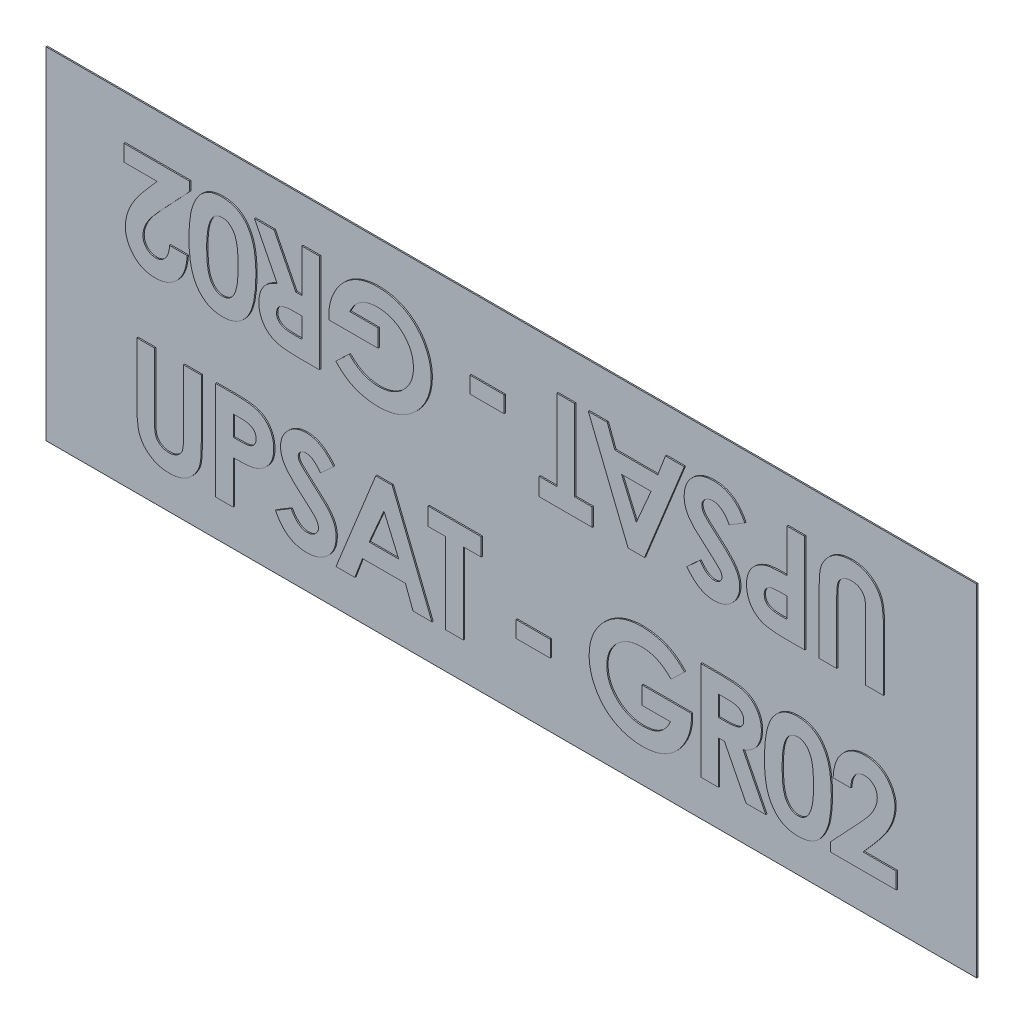
from build123d import *

# Parameters (mm, degrees)
SKETCH1_W           = 15
SKETCH1_H           = 5.5
BOSS_EXTRUDE1_DEPTH = 0.02
SKETCH2_W           = 0.549519231
SKETCH2_H           = 0.264583334
BOSS_EXTRUDE2_DEPTH = 0.02


with BuildPart() as part:
    # Sketch1 → Boss-Extrude1 (new body)
    with BuildSketch(Plane.XY):
        Rectangle(SKETCH1_W, SKETCH1_H)
    extrude(amount=BOSS_EXTRUDE1_DEPTH)

    # Sketch2 → Boss-Extrude2 (add)
    # profile 1 of 20: a face of its own
    with BuildSketch(Plane.XY.offset(0.02)):
        with BuildLine():
            Line((-6.016826923, -0.5625), (-5.731891026, -0.5625))
            Line((-5.731891026, -0.5625), (-5.731891026, -1.595392628))
            add(Edge.make_bspline(
                [(-5.731891026, -1.595392628), (-5.731875532, -1.606101211), (-5.731845607, -1.626784728), (-5.730347528, -1.656458803), (-5.728976682, -1.683735491), (-5.726503287, -1.70858493), (-5.722849236, -1.731017749), (-5.719310921, -1.75117805), (-5.714522163, -1.768704884), (-5.707325424, -1.78865501), (-5.696237613, -1.811070066), (-5.678120744, -1.834431552), (-5.657215427, -1.855752298), (-5.6321592, -1.87349888), (-5.603998218, -1.887854265), (-5.572887211, -1.898490017), (-5.538870036, -1.904402082), (-5.515349025, -1.905304667), (-5.503242688, -1.905769231)],
                knots=[0, 0, 0, 0, 1.155499968, 2.231836252, 3.205919964, 4.102923608, 4.924856345, 5.658536265, 6.31071849, 6.882491295, 7.94666036, 8.992281882, 10.060072772, 11.158554251, 12.289267114, 13.461410017, 14.693379945, 16, 16, 16, 16], degree=3))
            add(Edge.make_bspline(
                [(-5.503242688, -1.905769231), (-5.4903812, -1.905393923), (-5.465303475, -1.904662137), (-5.42923316, -1.897478864), (-5.395813808, -1.886040633), (-5.365753022, -1.869715362), (-5.339080716, -1.850146663), (-5.316503168, -1.827832215), (-5.29868505, -1.80272751), (-5.287071864, -1.779566509), (-5.280551632, -1.758248823), (-5.275664393, -1.739202281), (-5.272081506, -1.716729246), (-5.268830994, -1.691180683), (-5.266877686, -1.662291959), (-5.264759642, -1.630295401), (-5.263983359, -1.594972079), (-5.263851048, -1.570375787), (-5.263782051, -1.557549579)],
                knots=[0, 0, 0, 0, 1.261321664, 2.459363699, 3.594844139, 4.716940403, 5.803436589, 6.833651888, 7.818396249, 8.814403945, 9.360733334, 10.004355033, 10.743453831, 11.592799886, 12.532235708, 13.585170094, 14.740740724, 16, 16, 16, 16], degree=3))
            Line((-5.263782051, -1.557549579), (-5.263782051, -0.5625))
            Line((-5.263782051, -0.5625), (-4.978846154, -0.5625))
            Line((-4.978846154, -0.5625), (-4.978846154, -1.509530248))
            add(Edge.make_bspline(
                [(-4.978846154, -1.509530248), (-4.978885722, -1.528717036), (-4.978961809, -1.565611357), (-4.980130267, -1.618631093), (-4.982617703, -1.667056117), (-4.984706862, -1.710900579), (-4.9887501, -1.750105413), (-4.992962206, -1.784838035), (-4.998330898, -1.81497536), (-5.006319188, -1.849283042), (-5.020104611, -1.888787081), (-5.042328521, -1.93427427), (-5.070540337, -1.978808984), (-5.103885293, -2.021901309), (-5.141534799, -2.06193269), (-5.182654083, -2.097075061), (-5.226589865, -2.126801718), (-5.273801239, -2.150385807), (-5.324248028, -2.168779618), (-5.378429365, -2.181139333), (-5.436308301, -2.189489712), (-5.476286377, -2.190291869), (-5.496882512, -2.190705128)],
                knots=[0, 0, 0, 0, 1.170808336, 2.251350247, 3.235597562, 4.129743112, 4.929140599, 5.639994148, 6.264258765, 6.79612947, 7.788252245, 8.809469599, 9.879094798, 10.999557536, 12.129761673, 13.226370002, 14.293821979, 15.358369427, 16.438775801, 17.562147481, 18.744053101, 20, 20, 20, 20], degree=3))
            add(Edge.make_bspline(
                [(-5.496882512, -2.190705128), (-5.510566994, -2.190474631), (-5.537566196, -2.190019865), (-5.577273259, -2.186010018), (-5.615657936, -2.180101011), (-5.652648101, -2.171480378), (-5.688372142, -2.16034413), (-5.722820566, -2.146636184), (-5.755865355, -2.130433002), (-5.787321595, -2.111883618), (-5.817150576, -2.091825652), (-5.844412726, -2.069590553), (-5.870046198, -2.046822689), (-5.893310451, -2.022563893), (-5.914380223, -1.99706884), (-5.933212118, -1.970279751), (-5.94977816, -1.942199005), (-5.964495057, -1.912320448), (-5.977091285, -1.879125461), (-5.987710378, -1.841433285), (-5.996987468, -1.798653132), (-6.003881654, -1.75068862), (-6.010131963, -1.697697837), (-6.014088064, -1.639542732), (-6.016157679, -1.576221637), (-6.016598205, -1.532322435), (-6.016826923, -1.509530248)],
                knots=[0, 0, 0, 0, 1.001158378, 1.975264943, 2.917723546, 3.841610987, 4.75185031, 5.653588123, 6.552117133, 7.442167995, 8.324307438, 9.179605724, 10.014504199, 10.831958861, 11.636465792, 12.43274043, 13.225645099, 14.020104002, 14.867201867, 15.819789774, 16.883317127, 18.068162734, 19.364263498, 20.787406516, 22.332041935, 24, 24, 24, 24], degree=3))
            Line((-6.016826923, -1.509530248), (-6.016826923, -0.5625))
        make_face()
    # profile 2 of 20: a face of its own
    with BuildSketch(Plane.XY.offset(0.02)):
        with BuildLine():
            Line((-4.746826923, -0.5625), (-4.428818109, -0.5625))
            add(Edge.make_bspline(
                [(-4.428818109, -0.5625), (-4.408039826, -0.562593008), (-4.367954162, -0.56277244), (-4.310147336, -0.564948291), (-4.256817709, -0.568847549), (-4.207977533, -0.573666415), (-4.16364689, -0.580422278), (-4.123770265, -0.588167346), (-4.088339382, -0.597603093), (-4.056954705, -0.608803194), (-4.028787971, -0.622007675), (-4.002133156, -0.63607139), (-3.977592663, -0.652855938), (-3.953927857, -0.670552351), (-3.932491696, -0.690851161), (-3.911946866, -0.712401454), (-3.893163494, -0.736057895), (-3.876054547, -0.761534129), (-3.860534095, -0.788359466), (-3.846974391, -0.816581861), (-3.835975518, -0.846245972), (-3.826748831, -0.877159906), (-3.819337866, -0.909322318), (-3.814404892, -0.942931007), (-3.811054168, -0.977751305), (-3.810758513, -1.001450022), (-3.810608974, -1.013436498)],
                knots=[0, 0, 0, 0, 1.698747864, 3.27724071, 4.728299578, 6.070144658, 7.288476769, 8.393259625, 9.389771311, 10.283485332, 11.113357557, 11.931608583, 12.74405601, 13.541433047, 14.344816069, 15.154114104, 15.974336324, 16.810834471, 17.661136416, 18.50621059, 19.367396281, 20.244825668, 21.142564693, 22.063065223, 23.020325768, 24, 24, 24, 24], degree=3))
            add(Edge.make_bspline(
                [(-3.810608974, -1.013436498), (-3.810825337, -1.026696852), (-3.811250517, -1.052755075), (-3.815418651, -1.090953234), (-3.822539141, -1.127371719), (-3.831845248, -1.162317656), (-3.844821953, -1.195216105), (-3.859647228, -1.226852035), (-3.87788702, -1.256338469), (-3.898728898, -1.284044249), (-3.921490606, -1.310194635), (-3.946712507, -1.334034585), (-3.97391386, -1.355726614), (-4.002937206, -1.375498056), (-4.033891508, -1.393309029), (-4.066754431, -1.409326313), (-4.101750381, -1.423037626), (-4.126120507, -1.430208531), (-4.138476062, -1.433844151)],
                knots=[0, 0, 0, 0, 1.102006807, 2.165578795, 3.188629044, 4.184801286, 5.166646146, 6.124351954, 7.085497154, 8.042432466, 9.003981491, 9.963833307, 10.922997304, 11.89326795, 12.880200226, 13.889073926, 14.929769137, 16, 16, 16, 16], degree=3))
            add(Edge.make_bspline(
                [(-4.138476062, -1.433844151), (-4.14661414, -1.435868918), (-4.16424384, -1.440255216), (-4.19341615, -1.444708409), (-4.227034174, -1.448802846), (-4.265206622, -1.452321519), (-4.3079555, -1.454713397), (-4.355239417, -1.456581347), (-4.407079801, -1.45793954), (-4.443127554, -1.457987734), (-4.461891026, -1.458012821)],
                knots=[0, 0, 0, 0, 0.618981996, 1.340914327, 2.176866532, 3.120127938, 4.170906482, 5.338178032, 6.614476169, 8, 8, 8, 8], degree=3))
            Line((-4.461891026, -1.458012821), (-4.461891026, -2.15))
            Line((-4.461891026, -2.15), (-4.746826923, -2.15))
            Line((-4.746826923, -2.15), (-4.746826923, -0.5625))
        make_face()
        with BuildLine():
            Line((-4.461891026, -1.173076923), (-4.361082232, -1.173076923))
            add(Edge.make_bspline(
                [(-4.361082232, -1.173076923), (-4.34273848, -1.172960609), (-4.308985704, -1.172746591), (-4.262891332, -1.169651754), (-4.225849008, -1.164925315), (-4.196584884, -1.158146507), (-4.173478087, -1.147858768), (-4.15354992, -1.135957791), (-4.136457023, -1.120909334), (-4.12165709, -1.103713895), (-4.10982499, -1.083955475), (-4.101620045, -1.0619558), (-4.096290273, -1.038177108), (-4.09579802, -1.021628712), (-4.095544872, -1.01311849)],
                knots=[0, 0, 0, 0, 1.8619151, 3.425951444, 4.686033666, 5.651700536, 6.461346321, 7.243864085, 7.999046032, 8.762387399, 9.539336099, 10.322741239, 11.137448474, 12, 12, 12, 12], degree=3))
            add(Edge.make_bspline(
                [(-4.095544872, -1.01311849), (-4.095795416, -1.005683219), (-4.096281531, -0.991257008), (-4.099852666, -0.970436406), (-4.105544027, -0.95102731), (-4.113790591, -0.933232422), (-4.124451446, -0.917081979), (-4.137449186, -0.902582342), (-4.152617023, -0.88942299), (-4.16432748, -0.882457544), (-4.170276943, -0.87891877)],
                knots=[0, 0, 0, 0, 1.102301479, 2.1387299, 3.123554645, 4.094223062, 5.036071848, 5.982632524, 6.975082478, 8, 8, 8, 8], degree=3))
            add(Edge.make_bspline(
                [(-4.170276943, -0.87891877), (-4.175316482, -0.876370131), (-4.185986217, -0.87097414), (-4.204157812, -0.864700905), (-4.225127554, -0.859408741), (-4.249037014, -0.855016296), (-4.275790809, -0.851607302), (-4.305384167, -0.849000275), (-4.337860637, -0.847951887), (-4.360446078, -0.847612638), (-4.37221254, -0.847435897)],
                knots=[0, 0, 0, 0, 0.656809284, 1.390599849, 2.23162475, 3.173112763, 4.218524733, 5.370385145, 6.63003504, 8, 8, 8, 8], degree=3))
            Line((-4.37221254, -0.847435897), (-4.461891026, -0.847435897))
            Line((-4.461891026, -0.847435897), (-4.461891026, -1.173076923))
        make_face(mode=Mode.SUBTRACT)
    # profile 3 of 20: a face of its own
    with BuildSketch(Plane.XY.offset(0.02)):
        with BuildLine():
            Line((-2.845897436, -0.774611879), (-3.058963341, -0.969551282))
            add(Edge.make_bspline(
                [(-3.058963341, -0.969551282), (-3.068090171, -0.95667694), (-3.085612412, -0.931959998), (-3.114014136, -0.898863431), (-3.142287611, -0.870629595), (-3.170694775, -0.847376441), (-3.199487418, -0.829245246), (-3.228615559, -0.816408161), (-3.257914063, -0.808247503), (-3.277598135, -0.807231305), (-3.28729367, -0.806730769)],
                knots=[0, 0, 0, 0, 1.299362458, 2.494594718, 3.587462134, 4.587049575, 5.512617175, 6.380583204, 7.202344345, 8, 8, 8, 8], degree=3))
            add(Edge.make_bspline(
                [(-3.28729367, -0.806730769), (-3.296337386, -0.807047932), (-3.313798427, -0.807660289), (-3.338690436, -0.813747077), (-3.360789916, -0.824251978), (-3.380075298, -0.83798802), (-3.395352167, -0.854536767), (-3.407549562, -0.871892146), (-3.41441772, -0.891048561), (-3.415321705, -0.904205959), (-3.415769231, -0.910719651)],
                knots=[0, 0, 0, 0, 1.185010067, 2.2879431, 3.333075148, 4.379039566, 5.372662701, 6.27520591, 7.14612461, 8, 8, 8, 8], degree=3))
            add(Edge.make_bspline(
                [(-3.415769231, -0.910719651), (-3.415488789, -0.917327274), (-3.414924018, -0.930634109), (-3.409469098, -0.950136932), (-3.401246977, -0.96919346), (-3.393390405, -0.980794075), (-3.389374499, -0.986723758)],
                knots=[0, 0, 0, 0, 0.967525499, 1.948461899, 2.951351359, 4, 4, 4, 4], degree=3))
            add(Edge.make_bspline(
                [(-3.389374499, -0.986723758), (-3.385723606, -0.991332838), (-3.377319733, -1.001942332), (-3.361295268, -1.018746117), (-3.341171905, -1.039332224), (-3.316175256, -1.062992757), (-3.287342999, -1.090578643), (-3.253338722, -1.121005468), (-3.215141217, -1.155215517), (-3.187991316, -1.179038157), (-3.173764523, -1.191521434)],
                knots=[0, 0, 0, 0, 0.473873513, 1.090794244, 1.870441696, 2.795289791, 3.865433203, 5.087734844, 6.473946851, 8, 8, 8, 8], degree=3))
            add(Edge.make_bspline(
                [(-3.173764523, -1.191521434), (-3.160410632, -1.203078554), (-3.13506772, -1.225011565), (-3.09900979, -1.256141954), (-3.067320874, -1.284149206), (-3.039539338, -1.308612991), (-3.016086323, -1.329789992), (-2.996863232, -1.347781434), (-2.981635288, -1.362237056), (-2.972979094, -1.370968261), (-2.969284856, -1.374694511)],
                knots=[0, 0, 0, 0, 1.543621617, 2.929473131, 4.163658386, 5.240097082, 6.164993805, 6.925417477, 7.541396219, 8, 8, 8, 8], degree=3))
            add(Edge.make_bspline(
                [(-2.969284856, -1.374694511), (-2.955269687, -1.389861925), (-2.928327611, -1.419019022), (-2.89331241, -1.464203352), (-2.864493767, -1.508312471), (-2.842199118, -1.552176364), (-2.825361302, -1.5964279), (-2.813490419, -1.642152345), (-2.806380868, -1.689827491), (-2.805591542, -1.722359958), (-2.805192308, -1.738814603)],
                knots=[0, 0, 0, 0, 1.206664779, 2.319633467, 3.337109185, 4.282041471, 5.190008762, 6.099243693, 7.03861361, 8, 8, 8, 8], degree=3))
            add(Edge.make_bspline(
                [(-2.805192308, -1.738814603), (-2.805476473, -1.754847637), (-2.806034015, -1.786305047), (-2.812862835, -1.83233828), (-2.822600333, -1.876394082), (-2.837656212, -1.917993063), (-2.856006229, -1.957818058), (-2.879010625, -1.995248721), (-2.906026134, -2.030663864), (-2.936990055, -2.063430399), (-2.971239829, -2.093163759), (-3.007975966, -2.119633098), (-3.047557691, -2.141486909), (-3.089646824, -2.159481963), (-3.134220837, -2.173341995), (-3.181226626, -2.18358585), (-3.230736092, -2.18973405), (-3.264591378, -2.190376772), (-3.28188752, -2.190705128)],
                knots=[0, 0, 0, 0, 1.043214005, 2.046824704, 3.02475056, 3.976699089, 4.921714032, 5.875962561, 6.831408892, 7.817874052, 8.806269674, 9.781291748, 10.760897367, 11.74438705, 12.757449933, 13.795994037, 14.874007457, 16, 16, 16, 16], degree=3))
            add(Edge.make_bspline(
                [(-3.28188752, -2.190705128), (-3.295464844, -2.190464257), (-3.322355732, -2.189987195), (-3.361988836, -2.186092379), (-3.400259078, -2.17980656), (-3.43712335, -2.170797103), (-3.472747733, -2.159380899), (-3.507133689, -2.145436444), (-3.54004384, -2.128747603), (-3.571727201, -2.109657566), (-3.602029751, -2.087491517), (-3.631334654, -2.062702636), (-3.659350826, -2.034909658), (-3.686212822, -2.004178312), (-3.711748773, -1.970421574), (-3.736794562, -1.934109569), (-3.760237078, -1.894568397), (-3.774718564, -1.866829945), (-3.782115385, -1.852661759)],
                knots=[0, 0, 0, 0, 1.016823716, 2.013894106, 2.979844003, 3.91962641, 4.853723003, 5.779685073, 6.695824784, 7.614987388, 8.547259901, 9.504950863, 10.487499108, 11.500346958, 12.559593716, 13.656357062, 14.802919212, 16, 16, 16, 16], degree=3))
            Line((-3.782115385, -1.852661759), (-3.531524439, -1.70224359))
            add(Edge.make_bspline(
                [(-3.531524439, -1.70224359), (-3.522272121, -1.718326332), (-3.504534638, -1.749158323), (-3.474476813, -1.79058501), (-3.443684107, -1.82606011), (-3.411444618, -1.854956599), (-3.378150367, -1.877660859), (-3.343640536, -1.893886899), (-3.307890878, -1.903930799), (-3.283539835, -1.905157391), (-3.271393229, -1.905769231)],
                knots=[0, 0, 0, 0, 1.283663364, 2.460892379, 3.537111102, 4.529833553, 5.449777664, 6.316464042, 7.160231139, 8, 8, 8, 8], degree=3))
            add(Edge.make_bspline(
                [(-3.271393229, -1.905769231), (-3.259038392, -1.905269569), (-3.235068209, -1.904300154), (-3.200853839, -1.895345952), (-3.16948481, -1.881287198), (-3.142369653, -1.861227295), (-3.119410247, -1.838075119), (-3.102464888, -1.812317264), (-3.091819699, -1.784447886), (-3.090694244, -1.765087983), (-3.090128205, -1.755351062)],
                knots=[0, 0, 0, 0, 1.13588714, 2.203786484, 3.234766741, 4.283437687, 5.291419208, 6.222934724, 7.106237994, 8, 8, 8, 8], degree=3))
            add(Edge.make_bspline(
                [(-3.090128205, -1.755351062), (-3.090650919, -1.74629244), (-3.091712763, -1.727890719), (-3.099533974, -1.700530317), (-3.111760913, -1.673182359), (-3.126226244, -1.650750824), (-3.14094653, -1.631969507), (-3.155022443, -1.615696346), (-3.172163182, -1.597717352), (-3.192325286, -1.578009909), (-3.215242359, -1.556400527), (-3.240933707, -1.532891322), (-3.269693524, -1.507689382), (-3.290021019, -1.49052207), (-3.30065004, -1.481545473)],
                knots=[0, 0, 0, 0, 0.916159276, 1.861089862, 2.860218735, 3.940849679, 4.552606315, 5.27541173, 6.11797699, 7.06649574, 8.129236253, 9.306560635, 10.591630461, 12, 12, 12, 12], degree=3))
            add(Edge.make_bspline(
                [(-3.30065004, -1.481545473), (-3.320856233, -1.464449096), (-3.359638033, -1.431635975), (-3.414441636, -1.383172027), (-3.46382459, -1.337878027), (-3.50736037, -1.295194042), (-3.545603689, -1.255908347), (-3.578295547, -1.219701847), (-3.605076809, -1.18629526), (-3.633258313, -1.146727393), (-3.660036376, -1.098511228), (-3.683180221, -1.040501592), (-3.698194971, -0.982499317), (-3.699877165, -0.943559784), (-3.700705128, -0.92439403)],
                knots=[0, 0, 0, 0, 1.345494975, 2.582412109, 3.71882943, 4.751509156, 5.681369928, 6.505683931, 7.230279997, 7.856715994, 8.973648664, 10.023341002, 11.027102913, 12, 12, 12, 12], degree=3))
            add(Edge.make_bspline(
                [(-3.700705128, -0.92439403), (-3.700360779, -0.910802707), (-3.699682375, -0.88402634), (-3.693630903, -0.844655594), (-3.684586748, -0.806666132), (-3.671452039, -0.770196557), (-3.654404772, -0.735292548), (-3.633701528, -0.701783237), (-3.609020826, -0.669977034), (-3.58120734, -0.639895026), (-3.550564001, -0.612403494), (-3.517817698, -0.588139462), (-3.483153779, -0.567645708), (-3.4467843, -0.550644651), (-3.408483896, -0.537631421), (-3.368534722, -0.528406996), (-3.326879479, -0.522920602), (-3.298546483, -0.52217479), (-3.284113582, -0.521794872)],
                knots=[0, 0, 0, 0, 1.010766082, 1.991317756, 2.957454644, 3.913069143, 4.869106762, 5.843196583, 6.838735724, 7.860187025, 8.887984031, 9.89767229, 10.887916223, 11.879572884, 12.879850636, 13.892031539, 14.926195476, 16, 16, 16, 16], degree=3))
            add(Edge.make_bspline(
                [(-3.284113582, -0.521794872), (-3.265409256, -0.522479116), (-3.228148251, -0.523842203), (-3.17305678, -0.534501097), (-3.119245735, -0.551263332), (-3.075883786, -0.571485124), (-3.041381492, -0.591073983), (-3.014938708, -0.609108937), (-2.988031751, -0.629768946), (-2.960443634, -0.653119116), (-2.932686987, -0.679599393), (-2.903972555, -0.708579395), (-2.874691609, -0.740309576), (-2.855663637, -0.76297747), (-2.845897436, -0.774611879)],
                knots=[0, 0, 0, 0, 1.282922637, 2.555718331, 3.837320111, 5.142675274, 5.830281639, 6.55870424, 7.337177975, 8.157850921, 9.037902056, 9.96903443, 10.957596896, 12, 12, 12, 12], degree=3))
        make_face()
    # profile 4 of 20: a face of its own
    with BuildSketch(Plane.XY.offset(0.02)):
        Polygon((-2.165803786, -0.5625), (-1.901538462, -0.5625), (-1.260432692, -2.15), (-1.564767127, -2.15), (-1.688154547, -1.824358974), (-2.379823718, -1.824358974), (-2.503211138, -2.15), (-2.807227564, -2.15), align=None)
        Polygon((-2.033830128, -0.988313802), (-2.271700721, -1.539423077), (-1.795959535, -1.539423077), align=None, mode=Mode.SUBTRACT)
    # profile 5 of 20: a face of its own
    with BuildSketch(Plane.XY.offset(0.02)):
        Polygon((-1.323525641, -0.5625), (-0.468717949, -0.5625), (-0.468717949, -0.847435897), (-0.753653846, -0.847435897), (-0.753653846, -2.15), (-1.038589744, -2.15), (-1.038589744, -0.847435897), (-1.323525641, -0.847435897), align=None)
    # profile 6 of 20: a face of its own
    with BuildSketch(Plane.XY.offset(0.02)):
        with Locations((0.371842949, -1.569951923)):
            Rectangle(SKETCH2_W, SKETCH2_H)
    # profile 7 of 20: a face of its own
    with BuildSketch(Plane.XY.offset(0.02)):
        with BuildLine():
            Line((2.809762119, -0.814998998), (2.594152143, -1.021386719))
            add(Edge.make_bspline(
                [(2.594152143, -1.021386719), (2.577081925, -1.004296048), (2.543587339, -0.970761329), (2.488811134, -0.927113589), (2.43207961, -0.89000438), (2.373206039, -0.859490594), (2.312108413, -0.835821448), (2.248907301, -0.81889015), (2.183499884, -0.808847911), (2.139221982, -0.807442031), (2.116820913, -0.806730769)],
                knots=[0, 0, 0, 0, 1.075575784, 2.110457258, 3.113929901, 4.09197124, 5.059417775, 6.02750972, 7.002078037, 8, 8, 8, 8], degree=3))
            add(Edge.make_bspline(
                [(2.116820913, -0.806730769), (2.097399872, -0.807229147), (2.059264954, -0.808207757), (2.003229365, -0.815639249), (1.949683927, -0.828053223), (1.898375669, -0.845250711), (1.849617847, -0.867630078), (1.803127948, -0.894845925), (1.759192071, -0.927106456), (1.71815618, -0.963800122), (1.68079287, -1.003862198), (1.648172727, -1.046742785), (1.620387373, -1.091642625), (1.59751436, -1.138791434), (1.580110484, -1.188116846), (1.567686394, -1.239583055), (1.559800187, -1.293040491), (1.558869061, -1.329509708), (1.558397436, -1.347981771)],
                knots=[0, 0, 0, 0, 1.075001177, 2.110859044, 3.123021556, 4.114053297, 5.101481495, 6.087880186, 7.091499647, 8.114004866, 9.131394192, 10.11971144, 11.092043119, 12.050101265, 13.015322563, 13.981809771, 14.977764287, 16, 16, 16, 16], degree=3))
            add(Edge.make_bspline(
                [(1.558397436, -1.347981771), (1.558837346, -1.367093176), (1.559704028, -1.404745261), (1.56802949, -1.460001314), (1.580856297, -1.513161619), (1.599631323, -1.563831738), (1.622737694, -1.612705782), (1.652040379, -1.658837014), (1.686210243, -1.702929908), (1.725186228, -1.744216781), (1.767582034, -1.782273342), (1.813498071, -1.815101912), (1.861537293, -1.843425881), (1.912475053, -1.865857549), (1.965427224, -1.88386772), (2.020930893, -1.896566437), (2.078861078, -1.904357056), (2.118386321, -1.90529382), (2.138445513, -1.905769231)],
                knots=[0, 0, 0, 0, 1.022067601, 2.013613092, 2.983553406, 3.943623673, 4.90013463, 5.87121881, 6.861774014, 7.881098904, 8.905697761, 9.905387765, 10.89678721, 11.884561068, 12.87834324, 13.885584958, 14.926927371, 16, 16, 16, 16], degree=3))
            add(Edge.make_bspline(
                [(2.138445513, -1.905769231), (2.151493274, -1.905651503), (2.177108933, -1.905420377), (2.214682739, -1.901668558), (2.25066942, -1.896304896), (2.285208343, -1.889204044), (2.317950758, -1.879155065), (2.349350005, -1.867404022), (2.379222112, -1.853535447), (2.407405117, -1.83707085), (2.434318463, -1.818616049), (2.459710238, -1.797499832), (2.484025841, -1.774198293), (2.50698115, -1.74842677), (2.528187638, -1.719954834), (2.548324707, -1.689305697), (2.567161792, -1.656175183), (2.578292128, -1.632780092), (2.583975861, -1.620833333)],
                knots=[0, 0, 0, 0, 1.109579412, 2.178351274, 3.208885622, 4.204702371, 5.174744997, 6.119429583, 7.05542196, 7.97267548, 8.893247984, 9.828544973, 10.778894627, 11.756245826, 12.760884819, 13.796418446, 14.874735809, 16, 16, 16, 16], degree=3))
            Line((2.583975861, -1.620833333), (2.128269231, -1.620833333))
            Line((2.128269231, -1.620833333), (2.128269231, -1.335897436))
            Line((2.128269231, -1.335897436), (2.919793169, -1.335897436))
            Line((2.919793169, -1.335897436), (2.922019231, -1.403633313))
            add(Edge.make_bspline(
                [(2.922019231, -1.403633313), (2.921733198, -1.421029605), (2.921161644, -1.455791144), (2.915938238, -1.507545153), (2.907285744, -1.558612753), (2.895456957, -1.608942652), (2.880632495, -1.658781737), (2.861726665, -1.707652756), (2.839588054, -1.755887138), (2.814783311, -1.803279922), (2.786909916, -1.848754587), (2.756900115, -1.891813092), (2.725181715, -1.932380912), (2.691064857, -1.969892835), (2.655080795, -2.004663978), (2.617158694, -2.036560573), (2.577164426, -2.065609607), (2.535309856, -2.092056479), (2.491356583, -2.115235602), (2.445546261, -2.135398364), (2.397948057, -2.152522172), (2.348439085, -2.16655997), (2.297116765, -2.177391247), (2.243979998, -2.184818268), (2.188999601, -2.189865013), (2.151707561, -2.190421704), (2.132721354, -2.190705128)],
                knots=[0, 0, 0, 0, 1.006889344, 2.011981806, 3.007738725, 4.003571281, 5.003404394, 6.015442001, 7.03424805, 8.074616296, 9.110249922, 10.119753985, 11.111721717, 12.089233633, 13.052717867, 14.006597561, 14.955430184, 15.912305663, 16.870361111, 17.829300583, 18.807640451, 19.796414044, 20.806216501, 21.841577364, 22.90109906, 24, 24, 24, 24], degree=3))
            add(Edge.make_bspline(
                [(2.132721354, -2.190705128), (2.112464359, -2.190425242), (2.072308953, -2.189870423), (2.012933802, -2.184674171), (1.955281162, -2.176098093), (1.899336652, -2.164229093), (1.84497038, -2.149457174), (1.792275757, -2.130914923), (1.741360555, -2.108858328), (1.69207231, -2.083871457), (1.645040977, -2.055534169), (1.600371962, -2.024343362), (1.558309077, -1.990098398), (1.518421467, -1.953372548), (1.481641061, -1.913263084), (1.446597197, -1.871070151), (1.414987631, -1.825246278), (1.385453244, -1.777277091), (1.359214659, -1.727182689), (1.336268639, -1.675889596), (1.316700287, -1.623694798), (1.301270168, -1.570355259), (1.288742356, -1.516242907), (1.279778472, -1.461122419), (1.274716147, -1.405000696), (1.273881598, -1.367283991), (1.273461538, -1.34829978)],
                knots=[0, 0, 0, 0, 1.084149091, 2.14910686, 3.187506334, 4.202448172, 5.208724393, 6.201130722, 7.189831603, 8.176984443, 9.156919086, 10.126598231, 11.090766514, 12.05840148, 13.026036446, 14.001772938, 14.991905635, 16.003017641, 17.015720547, 18.016462227, 19.009322657, 19.99686681, 20.986544154, 21.980959929, 22.983742515, 24, 24, 24, 24], degree=3))
            add(Edge.make_bspline(
                [(1.273461538, -1.34829978), (1.274024088, -1.322401258), (1.275134956, -1.271259357), (1.285423283, -1.195927012), (1.301461252, -1.123050485), (1.324477351, -1.052895187), (1.354012442, -0.985364478), (1.389648133, -0.920299828), (1.432158509, -0.857770393), (1.465064459, -0.819055988), (1.481757312, -0.799416567)],
                knots=[0, 0, 0, 0, 1.034044851, 2.041932006, 3.031217818, 4.011390712, 4.986069675, 5.97149666, 6.970960976, 8, 8, 8, 8], degree=3))
            add(Edge.make_bspline(
                [(1.481757312, -0.799416567), (1.492121741, -0.788054566), (1.512694976, -0.765501165), (1.545581256, -0.734162755), (1.579301541, -0.704703491), (1.614322863, -0.677748037), (1.650461121, -0.652706326), (1.687820327, -0.630047784), (1.726204503, -0.609050952), (1.765913, -0.590788007), (1.806737939, -0.574413753), (1.848860125, -0.560558832), (1.891964074, -0.548286665), (1.936431471, -0.538950694), (1.98181309, -0.531176409), (2.028431065, -0.525965676), (2.076158359, -0.52214658), (2.1084387, -0.521913035), (2.124771134, -0.521794872)],
                knots=[0, 0, 0, 0, 1.020590567, 2.025856924, 3.013483481, 3.991664875, 4.957826714, 5.930500614, 6.890802512, 7.860442893, 8.829981142, 9.809047939, 10.802672283, 11.803273349, 12.823572789, 13.857849586, 14.916166035, 16, 16, 16, 16], degree=3))
            add(Edge.make_bspline(
                [(2.124771134, -0.521794872), (2.14184383, -0.522058162), (2.175812226, -0.522582013), (2.226317606, -0.526206721), (2.27612118, -0.531798791), (2.325013071, -0.540187214), (2.373157359, -0.550531887), (2.42030484, -0.563785973), (2.466763091, -0.578845002), (2.497007237, -0.590851172), (2.512105869, -0.596844952)],
                knots=[0, 0, 0, 0, 1.03180557, 2.052914215, 3.058998889, 4.059601663, 5.049854447, 6.033765722, 7.018406786, 8, 8, 8, 8], degree=3))
            add(Edge.make_bspline(
                [(2.512105869, -0.596844952), (2.524809501, -0.602384283), (2.550648335, -0.61365113), (2.588240655, -0.634264355), (2.625924823, -0.657116481), (2.663294208, -0.683043034), (2.70029187, -0.71199552), (2.737304103, -0.743516639), (2.773953073, -0.777973946), (2.797671186, -0.802497481), (2.809762119, -0.814998998)],
                knots=[0, 0, 0, 0, 0.894392155, 1.819168899, 2.76525314, 3.739198753, 4.75366411, 5.797420238, 6.877176959, 8, 8, 8, 8], degree=3))
        make_face()
    # profile 8 of 20: a face of its own
    with BuildSketch(Plane.XY.offset(0.02)):
        with BuildLine():
            Line((3.072628205, -0.5625), (3.404629407, -0.5625))
            add(Edge.make_bspline(
                [(3.404629407, -0.5625), (3.426574585, -0.562577893), (3.468781345, -0.562727703), (3.529641187, -0.565091304), (3.585549322, -0.568380449), (3.636588526, -0.573399772), (3.682736964, -0.580054788), (3.724040888, -0.58789995), (3.76049909, -0.596841195), (3.792419045, -0.607982691), (3.821225226, -0.620550129), (3.848076592, -0.634990346), (3.873565523, -0.651142546), (3.897521654, -0.669431736), (3.920153169, -0.689528899), (3.941502763, -0.711454264), (3.961268748, -0.735393749), (3.979328731, -0.761196087), (3.995788951, -0.788339555), (4.010336334, -0.816861421), (4.02216629, -0.846781521), (4.032619324, -0.877667443), (4.040148306, -0.909960709), (4.045384603, -0.943346937), (4.049218415, -0.977943652), (4.04943884, -1.001447124), (4.049551282, -1.013436498)],
                knots=[0, 0, 0, 0, 1.749336639, 3.364467119, 4.854658419, 6.213483162, 7.451590619, 8.570285859, 9.5643256, 10.440900261, 11.26203566, 12.067320669, 12.869050712, 13.665104639, 14.467235401, 15.27997916, 16.102287765, 16.939272006, 17.78853747, 18.631303466, 19.488103222, 20.351255419, 21.228522269, 22.127379805, 23.044756219, 24, 24, 24, 24], degree=3))
            add(Edge.make_bspline(
                [(4.049551282, -1.013436498), (4.049259199, -1.025950651), (4.048686478, -1.050488625), (4.04560149, -1.086532906), (4.039963101, -1.121017553), (4.03142294, -1.153841599), (4.021607135, -1.185413578), (4.008554632, -1.215150967), (3.993823592, -1.243486253), (3.976327966, -1.270018622), (3.957127371, -1.295337412), (3.934797484, -1.318472566), (3.910784937, -1.340667511), (3.883739898, -1.36053203), (3.854854537, -1.379409292), (3.823554934, -1.396517117), (3.790045359, -1.412285559), (3.766486468, -1.421079132), (3.754439103, -1.425575921)],
                knots=[0, 0, 0, 0, 1.099860209, 2.156625411, 3.176576793, 4.16617041, 5.135385252, 6.078461593, 7.016046972, 7.938469504, 8.868247731, 9.803980173, 10.76021508, 11.73834243, 12.748633912, 13.790971185, 14.870363756, 16, 16, 16, 16], degree=3))
            Line((3.754439103, -1.425575921), (4.120785256, -2.15))
            Line((4.120785256, -2.15), (3.804048478, -2.15))
            Line((3.804048478, -2.15), (3.454238782, -1.458012821))
            Line((3.454238782, -1.458012821), (3.357564103, -1.458012821))
            Line((3.357564103, -1.458012821), (3.357564103, -2.15))
            Line((3.357564103, -2.15), (3.072628205, -2.15))
            Line((3.072628205, -2.15), (3.072628205, -0.5625))
        make_face()
        with BuildLine():
            Line((3.357564103, -1.173076923), (3.468549179, -1.173076923))
            add(Edge.make_bspline(
                [(3.468549179, -1.173076923), (3.482118027, -1.172924102), (3.508099455, -1.172631481), (3.545464162, -1.171274187), (3.579400227, -1.168003778), (3.610053382, -1.163871739), (3.637577873, -1.159100704), (3.661728189, -1.15226352), (3.682876451, -1.144937304), (3.700772051, -1.135832719), (3.716061641, -1.12547883), (3.729263222, -1.113716555), (3.740182823, -1.10010322), (3.749170212, -1.085008776), (3.756161423, -1.068299717), (3.761264472, -1.050159469), (3.764116321, -1.030381393), (3.764444436, -1.016731828), (3.764615385, -1.009620393)],
                knots=[0, 0, 0, 0, 1.688639943, 3.233382647, 4.650958383, 5.928841754, 7.082724185, 8.122798841, 9.049171256, 9.863274652, 10.613301712, 11.341792392, 12.054588806, 12.776240173, 13.521029143, 14.301969904, 15.115324896, 16, 16, 16, 16], degree=3))
            add(Edge.make_bspline(
                [(3.764615385, -1.009620393), (3.764292191, -1.001207046), (3.763657338, -0.984680585), (3.757357622, -0.960888276), (3.747329835, -0.938866867), (3.733584486, -0.918715855), (3.716274005, -0.901050086), (3.696408863, -0.885477571), (3.673560322, -0.873163991), (3.652404292, -0.865042085), (3.633157249, -0.860182664), (3.615787401, -0.856561467), (3.595673012, -0.853995021), (3.572798897, -0.851272848), (3.547223363, -0.849507657), (3.518807008, -0.848219419), (3.487631444, -0.847692337), (3.465899114, -0.847523839), (3.454556791, -0.847435897)],
                knots=[0, 0, 0, 0, 1.020303359, 2.004196876, 2.966617323, 3.9489082, 4.950758222, 5.960522915, 7.003732012, 8.091992268, 8.70421221, 9.413913587, 10.24622431, 11.166358409, 12.212345909, 13.359657661, 14.621978493, 16, 16, 16, 16], degree=3))
            Line((3.454556791, -0.847435897), (3.357564103, -0.847435897))
            Line((3.357564103, -0.847435897), (3.357564103, -1.173076923))
        make_face(mode=Mode.SUBTRACT)
    # profile 9 of 20: a face of its own
    with BuildSketch(Plane.XY.offset(0.02)):
        with BuildLine():
            add(Edge.make_bspline(
                [(4.632970252, -0.521794872), (4.646762332, -0.521999619), (4.673881247, -0.522402207), (4.713822303, -0.526762562), (4.752296583, -0.533349843), (4.789454603, -0.542536802), (4.825028896, -0.554695416), (4.859278379, -0.569249068), (4.891795384, -0.586961127), (4.922994607, -0.606967808), (4.952864029, -0.629618207), (4.980685761, -0.655440831), (5.006967885, -0.683841501), (5.031141492, -0.715249584), (5.053741912, -0.74937939), (5.074694884, -0.786236331), (5.093840009, -0.826000797), (5.111391857, -0.868744546), (5.127086775, -0.915108289), (5.140306585, -0.965623837), (5.151644784, -1.020302727), (5.161215024, -1.079281063), (5.168448579, -1.142637241), (5.17332414, -1.210329171), (5.176669981, -1.282226352), (5.176943046, -1.331547227), (5.177083333, -1.356886018)],
                knots=[0, 0, 0, 0, 0.879237366, 1.728815576, 2.559023295, 3.367336655, 4.166867292, 4.954216142, 5.737608147, 6.525189134, 7.316157332, 8.124696809, 8.942788509, 9.781158001, 10.649253743, 11.551476218, 12.482711956, 13.461909668, 14.496590415, 15.601789533, 16.789733467, 18.056700938, 19.410929216, 20.8549011, 22.384193279, 24, 24, 24, 24], degree=3))
            add(Edge.make_bspline(
                [(5.177083333, -1.356886018), (5.17693172, -1.382541825), (5.176637138, -1.432390598), (5.173463228, -1.504945387), (5.167997604, -1.573128801), (5.160953113, -1.636933785), (5.151304088, -1.696326645), (5.140003738, -1.751461169), (5.126575258, -1.802317372), (5.110363354, -1.848780663), (5.092917748, -1.89159948), (5.073720253, -1.931286414), (5.053105479, -1.967948961), (5.031546268, -2.002140225), (5.007860663, -2.032852265), (4.98320151, -2.06112945), (4.956495105, -2.085894667), (4.928865891, -2.108424203), (4.899301699, -2.127894243), (4.868107416, -2.14492242), (4.834726902, -2.158734293), (4.799768627, -2.170747123), (4.76263672, -2.179371038), (4.723921203, -2.186213832), (4.683184984, -2.18999558), (4.655450126, -2.19046473), (4.641238482, -2.190705128)],
                knots=[0, 0, 0, 0, 1.643780988, 3.193836972, 4.651895693, 6.025988579, 7.305620092, 8.505800249, 9.631074763, 10.672816429, 11.65661981, 12.592235626, 13.49536222, 14.350718032, 15.179365177, 15.97804903, 16.751647189, 17.51006938, 18.259804725, 19.016521909, 19.783502495, 20.571750527, 21.382245291, 22.22305063, 23.089471752, 24, 24, 24, 24], degree=3))
            add(Edge.make_bspline(
                [(4.641238482, -2.190705128), (4.627027221, -2.190460093), (4.599187571, -2.189980073), (4.558341197, -2.186241951), (4.519420507, -2.179343318), (4.481994827, -2.170680915), (4.446324635, -2.158760873), (4.412238893, -2.144535758), (4.37999969, -2.127613829), (4.349517762, -2.108098425), (4.320897182, -2.085719628), (4.293693188, -2.060716806), (4.267965954, -2.033153332), (4.244106858, -2.002720474), (4.221725155, -1.969824447), (4.201054251, -1.934089595), (4.18210657, -1.895567945), (4.164289424, -1.854205804), (4.148808579, -1.809112691), (4.135031346, -1.759885932), (4.123745399, -1.706115179), (4.114668486, -1.647817708), (4.107421483, -1.585117024), (4.102030546, -1.517982864), (4.098839006, -1.446383958), (4.098547514, -1.397170464), (4.098397436, -1.371832432)],
                knots=[0, 0, 0, 0, 0.917216111, 1.796812873, 2.643793957, 3.46689424, 4.273913431, 5.068098542, 5.848489301, 6.620921603, 7.401012384, 8.190319798, 9.003608147, 9.831726257, 10.68377682, 11.569763213, 12.493818149, 13.453288342, 14.474581811, 15.568529029, 16.750744269, 18.018426408, 19.375425659, 20.823733699, 22.36466933, 24, 24, 24, 24], degree=3))
            add(Edge.make_bspline(
                [(4.098397436, -1.371832432), (4.098669287, -1.336627231), (4.099193829, -1.268698343), (4.105841199, -1.17056085), (4.115597853, -1.079849737), (4.129928067, -0.996716743), (4.147647178, -0.920853966), (4.170337423, -0.85276115), (4.196168616, -0.79149608), (4.218180111, -0.755202284), (4.22878105, -0.737722857)],
                knots=[0, 0, 0, 0, 1.288568992, 2.486310467, 3.599230591, 4.627010532, 5.572937695, 6.447898582, 7.252493626, 8, 8, 8, 8], degree=3))
            add(Edge.make_bspline(
                [(4.22878105, -0.737722857), (4.241107317, -0.720551073), (4.265207598, -0.686976851), (4.307347613, -0.642900174), (4.352621572, -0.605203641), (4.401959378, -0.57474036), (4.454580731, -0.550717013), (4.510937414, -0.533749594), (4.57082131, -0.523863585), (4.61194458, -0.52249474), (4.632970252, -0.521794872)],
                knots=[0, 0, 0, 0, 1.058512271, 2.069600068, 3.047294572, 4.004278952, 4.967380941, 5.939006123, 6.946246673, 8, 8, 8, 8], degree=3))
        make_face()
        with BuildLine():
            add(Edge.make_bspline(
                [(4.639966446, -0.806730769), (4.627498292, -0.807321735), (4.60305409, -0.808480342), (4.567584388, -0.818315277), (4.534138674, -0.833505864), (4.508697413, -0.851785361), (4.489654882, -0.869308451), (4.476349729, -0.885166278), (4.463519006, -0.90286247), (4.452186265, -0.923195564), (4.4414852, -0.94543497), (4.431027033, -0.969681641), (4.422454083, -0.996531126), (4.414031387, -1.025526177), (4.406652319, -1.057468429), (4.400470277, -1.092618975), (4.394947167, -1.131206402), (4.391094731, -1.173255985), (4.387503105, -1.218723729), (4.384928458, -1.26771092), (4.383852062, -1.320204341), (4.383509909, -1.356355782), (4.383333333, -1.37501252)],
                knots=[0, 0, 0, 0, 1.076674018, 2.110852608, 3.161083442, 4.239746716, 4.804137807, 5.395870207, 6.026861976, 6.692161227, 7.405688833, 8.16177676, 8.973626916, 9.841385931, 10.773283133, 11.807421078, 12.927755683, 14.143907515, 15.458935494, 16.872852025, 18.386167141, 20, 20, 20, 20], degree=3))
            add(Edge.make_bspline(
                [(4.383333333, -1.37501252), (4.383623956, -1.399183227), (4.384181245, -1.445532349), (4.387100068, -1.512184), (4.392950605, -1.57284237), (4.400227492, -1.627918562), (4.410448178, -1.677055393), (4.422207738, -1.720717743), (4.436729749, -1.758349023), (4.453512731, -1.790493465), (4.472100639, -1.817838675), (4.492278632, -1.841082227), (4.51335972, -1.861210046), (4.536001913, -1.877559625), (4.560151193, -1.89008919), (4.585605959, -1.89910155), (4.612382386, -1.904618392), (4.630718607, -1.9053834), (4.639966446, -1.905769231)],
                knots=[0, 0, 0, 0, 1.771748488, 3.397459088, 4.888034009, 6.237357457, 7.467047327, 8.564189669, 9.548206622, 10.417051504, 11.216568818, 11.965764335, 12.669334354, 13.348544111, 14.005342236, 14.656555988, 15.322436492, 16, 16, 16, 16], degree=3))
            add(Edge.make_bspline(
                [(4.639966446, -1.905769231), (4.648896929, -1.905505217), (4.666381704, -1.90498831), (4.691878421, -1.899682334), (4.715989929, -1.891055969), (4.738643427, -1.878853369), (4.759919944, -1.863335897), (4.779715492, -1.844435362), (4.797880779, -1.82196337), (4.808463957, -1.805285828), (4.813917268, -1.796692208)],
                knots=[0, 0, 0, 0, 0.992283464, 1.942767638, 2.88273346, 3.832339453, 4.79467288, 5.803907806, 6.868395428, 8, 8, 8, 8], degree=3))
            add(Edge.make_bspline(
                [(4.813917268, -1.796692208), (4.820337623, -1.7849493), (4.833800586, -1.760325375), (4.849379951, -1.71877342), (4.862493791, -1.671909682), (4.873780682, -1.619588317), (4.881500227, -1.561602963), (4.88814829, -1.49832131), (4.891354816, -1.429424698), (4.891876375, -1.381692876), (4.892147436, -1.356886018)],
                knots=[0, 0, 0, 0, 0.710965849, 1.490837728, 2.352621235, 3.297892224, 4.334225155, 5.461620853, 6.680770821, 8, 8, 8, 8], degree=3))
            add(Edge.make_bspline(
                [(4.892147436, -1.356886018), (4.892042731, -1.331863824), (4.891841192, -1.283700372), (4.888143529, -1.214556072), (4.882994251, -1.151404228), (4.875462345, -1.094385835), (4.865771178, -1.043362476), (4.853826778, -0.998337487), (4.839745219, -0.959222132), (4.823046168, -0.926055414), (4.804550932, -0.897868253), (4.784917674, -0.873685856), (4.764063377, -0.853039536), (4.742022916, -0.835851596), (4.718286157, -0.822718721), (4.693306503, -0.813445824), (4.667032744, -0.807836033), (4.649110321, -0.807104163), (4.639966446, -0.806730769)],
                knots=[0, 0, 0, 0, 1.793836731, 3.452829483, 4.963243077, 6.335886805, 7.574563692, 8.684454726, 9.672768357, 10.54971625, 11.340229787, 12.085688095, 12.778991901, 13.440269426, 14.083255152, 14.715733572, 15.344777694, 16, 16, 16, 16], degree=3))
        make_face(mode=Mode.SUBTRACT)
    # profile 10 of 20: a face of its own
    with BuildSketch(Plane.XY.offset(0.02)):
        with BuildLine():
            Line((5.490512821, -1.091666667), (5.205576923, -1.091666667))
            add(Edge.make_bspline(
                [(5.205576923, -1.091666667), (5.206807518, -1.070112773), (5.209212025, -1.02799776), (5.218776549, -0.966824355), (5.231592682, -0.909022214), (5.248697514, -0.854793535), (5.270190854, -0.804158024), (5.295519624, -0.756943061), (5.325330915, -0.713397233), (5.358990246, -0.673730544), (5.395926174, -0.638145192), (5.435371873, -0.606592983), (5.477930717, -0.580556894), (5.522825123, -0.559131603), (5.570047444, -0.542013791), (5.62004448, -0.530569149), (5.672383327, -0.522818725), (5.708213507, -0.522140532), (5.726475361, -0.521794872)],
                knots=[0, 0, 0, 0, 1.199038563, 2.342849363, 3.436047546, 4.486744587, 5.497670872, 6.488682221, 7.459191391, 8.424610317, 9.374430501, 10.305433194, 11.225809216, 12.140057399, 13.06607119, 14.010487599, 14.985989317, 16, 16, 16, 16], degree=3))
            add(Edge.make_bspline(
                [(5.726475361, -0.521794872), (5.748891527, -0.522494315), (5.792653137, -0.523859793), (5.856242228, -0.53550777), (5.915627486, -0.554990812), (5.970765745, -0.582213759), (6.021187601, -0.61679766), (6.066884694, -0.658033302), (6.106475071, -0.706785831), (6.140209747, -0.761026732), (6.16823923, -0.818460213), (6.187881125, -0.877848814), (6.200791531, -0.937616602), (6.202168506, -0.977861206), (6.202852564, -0.997854067)],
                knots=[0, 0, 0, 0, 1.075374347, 2.099382735, 3.09057751, 4.06680945, 5.040638231, 6.016817125, 7.011024321, 8.044445721, 9.0776792, 10.070479129, 11.0414456, 12, 12, 12, 12], degree=3))
            add(Edge.make_bspline(
                [(6.202852564, -0.997854067), (6.202586228, -1.009947162), (6.202050159, -1.034287575), (6.198322799, -1.071120594), (6.192731023, -1.108639331), (6.184299988, -1.146811616), (6.173785795, -1.185648149), (6.16103056, -1.225265156), (6.145738412, -1.265438021), (6.128164546, -1.306618885), (6.107198879, -1.348941444), (6.082787275, -1.393040132), (6.054281793, -1.438875827), (6.022026744, -1.486707335), (5.985865473, -1.536459217), (5.945621453, -1.587981605), (5.9017582, -1.641456048), (5.870627215, -1.677200712), (5.854632913, -1.695565405)],
                knots=[0, 0, 0, 0, 0.728284026, 1.46585585, 2.227944881, 3.01186502, 3.81876927, 4.650621989, 5.517437689, 6.406905708, 7.346299482, 8.360816762, 9.441613733, 10.596154504, 11.834900912, 13.145207542, 14.533280747, 16, 16, 16, 16], degree=3))
            Line((5.854632913, -1.695565405), (5.688950321, -1.885416667))
            Line((5.688950321, -1.885416667), (6.223205128, -1.885416667))
            Line((6.223205128, -1.885416667), (6.223205128, -2.15))
            Line((6.223205128, -2.15), (5.164871795, -2.15))
            Line((5.164871795, -2.15), (5.164871795, -2.005623998))
            Line((5.164871795, -2.005623998), (5.634888822, -1.505396134))
            add(Edge.make_bspline(
                [(5.634888822, -1.505396134), (5.648497023, -1.490804332), (5.674852072, -1.462544338), (5.712352591, -1.421041531), (5.746287249, -1.381656358), (5.775952381, -1.343969446), (5.802904777, -1.309203205), (5.825942631, -1.276309738), (5.845276722, -1.245586413), (5.866266619, -1.208539448), (5.886200122, -1.164354351), (5.904490317, -1.113451307), (5.915639456, -1.06479972), (5.91717839, -1.0330973), (5.917916667, -1.017888622)],
                knots=[0, 0, 0, 0, 1.246127091, 2.413378631, 3.493388633, 4.492180848, 5.408488754, 6.240484944, 6.999099869, 7.674939598, 8.898438119, 10.020720584, 11.050475521, 12, 12, 12, 12], degree=3))
            add(Edge.make_bspline(
                [(5.917916667, -1.017888622), (5.917364675, -1.003175399), (5.916295103, -0.974666171), (5.904541374, -0.934111946), (5.88633209, -0.897394235), (5.860672636, -0.865610204), (5.829591001, -0.839491159), (5.793673252, -0.820064547), (5.753212224, -0.808855481), (5.724848273, -0.807452506), (5.710256911, -0.806730769)],
                knots=[0, 0, 0, 0, 1.062038974, 2.057870785, 3.028805853, 4.01125022, 4.991535629, 5.949134679, 6.94496649, 8, 8, 8, 8], degree=3))
            add(Edge.make_bspline(
                [(5.710256911, -0.806730769), (5.702718827, -0.806997387), (5.687878899, -0.807522268), (5.666065365, -0.811016258), (5.64530822, -0.817174051), (5.625376425, -0.825424626), (5.606482698, -0.836360823), (5.588674696, -0.849841429), (5.571764787, -0.865523869), (5.555830529, -0.883359108), (5.541328273, -0.90326324), (5.528447423, -0.925054481), (5.517797104, -0.948719305), (5.508420176, -0.973945301), (5.501188241, -1.001003415), (5.495922495, -1.029731708), (5.4919193, -1.060083444), (5.490990176, -1.080947407), (5.490512821, -1.091666667)],
                knots=[0, 0, 0, 0, 0.903469896, 1.778625579, 2.63899355, 3.493148037, 4.358286772, 5.247621495, 6.164656832, 7.118446693, 8.109501108, 9.111810964, 10.146451449, 11.215617525, 12.33435995, 13.498009769, 14.714554818, 16, 16, 16, 16], degree=3))
        make_face()
    # profile 11 of 20: a face of its own
    with BuildSketch(Plane.XY.offset(0.02)):
        with BuildLine():
            Line((6.016826923, 0.4625), (5.731891026, 0.4625))
            Line((5.731891026, 0.4625), (5.731891026, 1.495392628))
            add(Edge.make_bspline(
                [(5.731891026, 1.495392628), (5.731874902, 1.506101137), (5.73184376, 1.526784511), (5.730354062, 1.556459569), (5.72895004, 1.583838313), (5.726561142, 1.608698815), (5.722813987, 1.631118248), (5.719315491, 1.651179211), (5.714518987, 1.668702925), (5.707336201, 1.688663149), (5.696122249, 1.71108632), (5.67833593, 1.734721263), (5.657096053, 1.755758358), (5.632082852, 1.773422084), (5.604156481, 1.788362267), (5.572766592, 1.798243947), (5.538933624, 1.804946513), (5.515362169, 1.805489863), (5.503242688, 1.805769231)],
                knots=[0, 0, 0, 0, 1.155195489, 2.231248153, 3.20507519, 4.113220553, 4.92363642, 5.657123012, 6.309133385, 6.880755525, 7.944644177, 8.999147208, 10.058600405, 11.156792429, 12.29246015, 13.460660758, 14.694375292, 16, 16, 16, 16], degree=3))
            add(Edge.make_bspline(
                [(5.503242688, 1.805769231), (5.49037968, 1.80539797), (5.465298991, 1.804674074), (5.429151118, 1.797415075), (5.395566693, 1.786125666), (5.365463304, 1.769684066), (5.338732348, 1.750275324), (5.316555086, 1.727613244), (5.298290594, 1.702855991), (5.286809203, 1.679546613), (5.280149803, 1.658296292), (5.27578737, 1.639146142), (5.272068389, 1.616842096), (5.268799561, 1.591288184), (5.26689684, 1.562396942), (5.264755897, 1.530295548), (5.263984434, 1.494972036), (5.263851416, 1.470375772), (5.263782051, 1.457549579)],
                knots=[0, 0, 0, 0, 1.260834212, 2.45841325, 3.603280198, 4.724942815, 5.811019112, 6.833506895, 7.823953325, 8.819576102, 9.365694356, 10.006623749, 10.745436914, 11.584131356, 12.533575865, 13.586103333, 14.74122738, 16, 16, 16, 16], degree=3))
            Line((5.263782051, 1.457549579), (5.263782051, 0.4625))
            Line((5.263782051, 0.4625), (4.978846154, 0.4625))
            Line((4.978846154, 0.4625), (4.978846154, 1.409530248))
            add(Edge.make_bspline(
                [(4.978846154, 1.409530248), (4.978880601, 1.428717391), (4.97894684, 1.465612394), (4.980182789, 1.518627457), (4.982446906, 1.567074475), (4.985257391, 1.610865634), (4.988627728, 1.650126033), (4.992989529, 1.684835643), (4.998325248, 1.714975851), (5.006322003, 1.749282811), (5.02010372, 1.788787044), (5.042328495, 1.834274718), (5.070541469, 1.878807102), (5.103880543, 1.921908744), (5.141552518, 1.961905064), (5.182546108, 1.99713514), (5.226639104, 2.026330277), (5.273527443, 2.050193843), (5.324081799, 2.068401145), (5.378279229, 2.081211295), (5.436314709, 2.089465058), (5.476288556, 2.090283486), (5.496882512, 2.090705128)],
                knots=[0, 0, 0, 0, 1.170912322, 2.251550202, 3.235884933, 4.130507595, 4.929373885, 5.640290569, 6.26461063, 6.796528574, 7.788739464, 8.810047518, 9.879767716, 11.000329969, 12.130634485, 13.227340211, 14.291294104, 15.350161901, 16.430664233, 17.561930962, 18.743941553, 20, 20, 20, 20], degree=3))
            add(Edge.make_bspline(
                [(5.496882512, 2.090705128), (5.510566783, 2.090473945), (5.537565568, 2.090017824), (5.57727566, 2.08601782), (5.615649324, 2.080073023), (5.652710646, 2.071574889), (5.688318241, 2.059950819), (5.722663692, 2.046332353), (5.755783168, 2.030456068), (5.786930796, 2.0115345), (5.816756185, 1.991390057), (5.844494322, 1.969719701), (5.870021711, 1.946792212), (5.893316842, 1.922571846), (5.914378538, 1.897066747), (5.933212578, 1.870280309), (5.94977799, 1.842198849), (5.964495285, 1.812320519), (5.977090459, 1.77912533), (5.987714013, 1.741433814), (5.996949294, 1.698753305), (6.003940441, 1.650802646), (6.010102266, 1.59780016), (6.014094876, 1.539543576), (6.016155754, 1.476221398), (6.016597547, 1.432322353), (6.016826923, 1.409530248)],
                knots=[0, 0, 0, 0, 1.001274302, 1.975493657, 2.918061388, 3.842055805, 4.754744607, 5.656586832, 6.54484551, 7.438946169, 8.321187755, 9.177850665, 10.012845812, 10.830395126, 11.634995211, 12.431362049, 13.224358528, 14.018909421, 14.866105371, 15.818803578, 16.882454076, 18.059767828, 19.363726729, 20.787034531, 22.331848803, 24, 24, 24, 24], degree=3))
            Line((6.016826923, 1.409530248), (6.016826923, 0.4625))
        make_face()
    # profile 12 of 20: a face of its own
    with BuildSketch(Plane.XY.offset(0.02)):
        with BuildLine():
            Line((4.746826923, 0.4625), (4.428818109, 0.4625))
            add(Edge.make_bspline(
                [(4.428818109, 0.4625), (4.408039825, 0.462593008), (4.367954161, 0.46277244), (4.310147337, 0.464948293), (4.256817705, 0.468847544), (4.207977548, 0.473666433), (4.163646843, 0.48042222), (4.123770416, 0.488167534), (4.0883389, 0.497602492), (4.056956255, 0.508805127), (4.028782657, 0.522001044), (4.002152674, 0.536095744), (3.977467104, 0.552802829), (3.9541464, 0.57091802), (3.932366972, 0.590818186), (3.91196743, 0.612424678), (3.893157833, 0.636051501), (3.876056105, 0.661535889), (3.860533678, 0.688358995), (3.846974504, 0.716581989), (3.835975486, 0.746245936), (3.826748839, 0.777159916), (3.819337864, 0.809322315), (3.814404893, 0.842931007), (3.811054168, 0.877751305), (3.810758512, 0.901450022), (3.810608974, 0.913436498)],
                knots=[0, 0, 0, 0, 1.698787518, 3.27731721, 4.728409951, 6.070286353, 7.288646904, 8.393455548, 9.389990496, 10.283725379, 11.113616976, 11.931887102, 12.744353494, 13.547053751, 14.344590688, 15.153907614, 15.974148981, 16.810666655, 17.660988447, 18.506082349, 19.367288142, 20.244738011, 21.142497992, 22.06302001, 23.020302899, 24, 24, 24, 24], degree=3))
            add(Edge.make_bspline(
                [(3.810608974, 0.913436498), (3.810824399, 0.926697236), (3.811247736, 0.952756214), (3.815429155, 0.990948932), (3.822501795, 1.027387014), (3.831970079, 1.062226126), (3.844320136, 1.09539005), (3.859798891, 1.126660924), (3.877504467, 1.156430597), (3.898406603, 1.184154577), (3.92150353, 1.209973993), (3.946373641, 1.234169824), (3.973763175, 1.255747577), (4.002694515, 1.275829052), (4.033995468, 1.293235551), (4.066738646, 1.309353242), (4.10175451, 1.32303058), (4.126121897, 1.330206161), (4.138476062, 1.333844151)],
                knots=[0, 0, 0, 0, 1.101767505, 2.165108537, 3.187936629, 4.183892551, 5.162396277, 6.123736501, 7.080098904, 8.036826416, 9.0040019, 9.957275584, 10.916231297, 11.898534744, 12.880877694, 13.889532316, 14.930001539, 16, 16, 16, 16], degree=3))
            add(Edge.make_bspline(
                [(4.138476062, 1.333844151), (4.14661414, 1.335868918), (4.16424384, 1.340255216), (4.19341615, 1.344708409), (4.227034174, 1.348802846), (4.265206622, 1.352321519), (4.3079555, 1.354713397), (4.355239417, 1.356581347), (4.407079801, 1.35793954), (4.443127554, 1.357987734), (4.461891026, 1.358012821)],
                knots=[0, 0, 0, 0, 0.618981996, 1.340914327, 2.176866532, 3.120127938, 4.170906482, 5.338178032, 6.614476169, 8, 8, 8, 8], degree=3))
            Line((4.461891026, 1.358012821), (4.461891026, 2.05))
            Line((4.461891026, 2.05), (4.746826923, 2.05))
            Line((4.746826923, 2.05), (4.746826923, 0.4625))
        make_face()
        with BuildLine():
            Line((4.461891026, 1.073076923), (4.361082232, 1.073076923))
            add(Edge.make_bspline(
                [(4.361082232, 1.073076923), (4.34273818, 1.072961042), (4.308984853, 1.07274782), (4.262893892, 1.069648058), (4.22584216, 1.064935204), (4.196602748, 1.058120707), (4.173506556, 1.047973904), (4.153826208, 1.035735807), (4.136341449, 1.021029515), (4.121766528, 1.003398961), (4.109889376, 0.983728875), (4.101558882, 0.96187073), (4.096301031, 0.938173841), (4.095801673, 0.921627602), (4.095544872, 0.91311849)],
                knots=[0, 0, 0, 0, 1.862351722, 3.426754836, 4.68713255, 5.653025869, 6.462861518, 7.236406327, 7.999926698, 8.771672214, 9.54880311, 10.322347919, 11.137246204, 12, 12, 12, 12], degree=3))
            add(Edge.make_bspline(
                [(4.095544872, 0.91311849), (4.095793665, 0.90568233), (4.096276383, 0.891254392), (4.099871435, 0.870445944), (4.105451138, 0.851086223), (4.113978632, 0.833445098), (4.124331787, 0.817111105), (4.137466052, 0.802592726), (4.152612559, 0.789420242), (4.164325976, 0.782456618), (4.170276943, 0.77891877)],
                knots=[0, 0, 0, 0, 1.102449765, 2.139017612, 3.12397484, 4.080535277, 5.035673127, 5.982361139, 6.974944601, 8, 8, 8, 8], degree=3))
            add(Edge.make_bspline(
                [(4.170276943, 0.77891877), (4.175316482, 0.776370131), (4.185986217, 0.77097414), (4.204157812, 0.764700905), (4.225127554, 0.759408741), (4.249037014, 0.755016296), (4.275790809, 0.751607302), (4.305384167, 0.749000275), (4.337860637, 0.747951887), (4.360446078, 0.747612638), (4.37221254, 0.747435897)],
                knots=[0, 0, 0, 0, 0.656809284, 1.390599849, 2.23162475, 3.173112763, 4.218524733, 5.370385145, 6.63003504, 8, 8, 8, 8], degree=3))
            Line((4.37221254, 0.747435897), (4.461891026, 0.747435897))
            Line((4.461891026, 0.747435897), (4.461891026, 1.073076923))
        make_face(mode=Mode.SUBTRACT)
    # profile 13 of 20: a face of its own
    with BuildSketch(Plane.XY.offset(0.02)):
        with BuildLine():
            Line((2.845897436, 0.674611879), (3.058963341, 0.869551282))
            add(Edge.make_bspline(
                [(3.058963341, 0.869551282), (3.068088415, 0.85667464), (3.085607284, 0.831953282), (3.114032086, 0.798886939), (3.142287071, 0.770493837), (3.170949939, 0.74758577), (3.199527207, 0.729144053), (3.228626013, 0.716424058), (3.257911597, 0.708243753), (3.277597321, 0.707230067), (3.28729367, 0.706730769)],
                knots=[0, 0, 0, 0, 1.299459705, 2.494781419, 3.587730629, 4.594196874, 5.512431013, 6.380462003, 7.202284646, 8, 8, 8, 8], degree=3))
            add(Edge.make_bspline(
                [(3.28729367, 0.706730769), (3.29634185, 0.707038502), (3.313811509, 0.707632652), (3.338599802, 0.713835651), (3.360876271, 0.723859364), (3.38004753, 0.737705523), (3.395470392, 0.754241856), (3.407462588, 0.771845589), (3.414431276, 0.791039455), (3.415326194, 0.804202944), (3.415769231, 0.810719651)],
                knots=[0, 0, 0, 0, 1.184157716, 2.286297433, 3.324836695, 4.370048774, 5.362957217, 6.276446515, 7.146738784, 8, 8, 8, 8], degree=3))
            add(Edge.make_bspline(
                [(3.415769231, 0.810719651), (3.415488789, 0.817327274), (3.414924018, 0.830634109), (3.409469098, 0.850136932), (3.401246977, 0.86919346), (3.393390405, 0.880794075), (3.389374499, 0.886723758)],
                knots=[0, 0, 0, 0, 0.967525499, 1.948461899, 2.951351359, 4, 4, 4, 4], degree=3))
            add(Edge.make_bspline(
                [(3.389374499, 0.886723758), (3.385708884, 0.891319126), (3.377222366, 0.901958178), (3.361532103, 0.919077886), (3.341016139, 0.93917547), (3.316541602, 0.963263593), (3.287190009, 0.990406584), (3.25359155, 1.021390338), (3.214998701, 1.055162361), (3.18796047, 1.07900387), (3.173764523, 1.091521434)],
                knots=[0, 0, 0, 0, 0.473849886, 1.097042329, 1.870584189, 2.789244661, 3.865562256, 5.093556389, 6.47402294, 8, 8, 8, 8], degree=3))
            add(Edge.make_bspline(
                [(3.173764523, 1.091521434), (3.160407656, 1.10307522), (3.135059096, 1.125001906), (3.09903884, 1.156174494), (3.067176926, 1.18409384), (3.039763126, 1.208969012), (3.015978252, 1.22977562), (2.996874252, 1.247793714), (2.981633516, 1.262235081), (2.972978564, 1.27096767), (2.969284856, 1.274694511)],
                knots=[0, 0, 0, 0, 1.543627419, 2.929484142, 4.163674036, 5.24627963, 6.164986907, 6.925413438, 7.541394495, 8, 8, 8, 8], degree=3))
            add(Edge.make_bspline(
                [(2.969284856, 1.274694511), (2.955263058, 1.289857188), (2.928308238, 1.319005178), (2.893345145, 1.364297675), (2.864259232, 1.408170573), (2.84173517, 1.45186277), (2.825399725, 1.496277207), (2.813508099, 1.542047567), (2.806380218, 1.589828276), (2.805591324, 1.622360222), (2.805192308, 1.638814603)],
                knots=[0, 0, 0, 0, 1.206413378, 2.319150186, 3.339784753, 4.27899982, 5.184598145, 6.099639703, 7.038813909, 8, 8, 8, 8], degree=3))
            add(Edge.make_bspline(
                [(2.805192308, 1.638814603), (2.805476666, 1.654847512), (2.806034588, 1.686304675), (2.812860665, 1.732339685), (2.822608162, 1.776389015), (2.837627907, 1.818011381), (2.856088355, 1.857700042), (2.878587191, 1.895468344), (2.906094265, 1.930434548), (2.936646607, 1.96354214), (2.970968941, 1.993259654), (3.007876501, 2.019459477), (3.047439575, 2.041580644), (3.089356662, 2.059810765), (3.134153471, 2.073339527), (3.18112232, 2.08356806), (3.230736438, 2.089735382), (3.264591495, 2.090377222), (3.28188752, 2.090705128)],
                knots=[0, 0, 0, 0, 1.043039441, 2.046482205, 3.024244422, 3.976033659, 4.920890471, 5.871402525, 6.830893638, 7.812473116, 8.800703348, 9.781190227, 10.754606487, 11.746997808, 12.751247331, 13.796362838, 14.874195872, 16, 16, 16, 16], degree=3))
            add(Edge.make_bspline(
                [(3.28188752, 2.090705128), (3.295464952, 2.090464518), (3.322356053, 2.089987972), (3.361987599, 2.08608938), (3.400263508, 2.079817298), (3.437107333, 2.070758279), (3.472752131, 2.059541684), (3.50681108, 2.044956102), (3.539737013, 2.028461737), (3.571420432, 2.009347439), (3.601598794, 1.987148037), (3.631141593, 1.962739728), (3.659001508, 1.934783821), (3.686242989, 1.904299458), (3.711728299, 1.870403129), (3.736800375, 1.834114806), (3.760235522, 1.794566995), (3.774718037, 1.766829471), (3.782115385, 1.752661759)],
                knots=[0, 0, 0, 0, 1.017088714, 2.014418954, 2.980620591, 3.920647918, 4.854987948, 5.776890852, 6.693269322, 7.612671471, 8.545186947, 9.498010697, 10.480815007, 11.499174288, 12.558697099, 13.655746277, 14.802607237, 16, 16, 16, 16], degree=3))
            Line((3.782115385, 1.752661759), (3.531524439, 1.60224359))
            add(Edge.make_bspline(
                [(3.531524439, 1.60224359), (3.522272121, 1.618326332), (3.504534638, 1.649158323), (3.474476813, 1.69058501), (3.443684107, 1.72606011), (3.411444618, 1.754956599), (3.378150367, 1.777660859), (3.343640536, 1.793886899), (3.307890878, 1.803930799), (3.283539835, 1.805157391), (3.271393229, 1.805769231)],
                knots=[0, 0, 0, 0, 1.283663364, 2.460892379, 3.537111102, 4.529833553, 5.449777664, 6.316464042, 7.160231139, 8, 8, 8, 8], degree=3))
            add(Edge.make_bspline(
                [(3.271393229, 1.805769231), (3.259036117, 1.805274317), (3.235061519, 1.804314113), (3.200784513, 1.795269965), (3.169220326, 1.78138839), (3.142083141, 1.761199774), (3.119038454, 1.738178879), (3.102517782, 1.712214935), (3.091801399, 1.6844598), (3.09068812, 1.66509197), (3.090128205, 1.655351062)],
                knots=[0, 0, 0, 0, 1.13537643, 2.202795631, 3.242191317, 4.290390765, 5.297919085, 6.223733717, 7.106639842, 8, 8, 8, 8], degree=3))
            add(Edge.make_bspline(
                [(3.090128205, 1.655351062), (3.090652302, 1.64629328), (3.091716954, 1.627893263), (3.099516175, 1.600519514), (3.11181105, 1.573278499), (3.125920863, 1.550698203), (3.140631103, 1.531876587), (3.155049956, 1.515813723), (3.17213879, 1.497695765), (3.19233304, 1.478016771), (3.215239929, 1.456398376), (3.24093445, 1.432891979), (3.26969331, 1.407689193), (3.290020945, 1.390522005), (3.30065004, 1.381545473)],
                knots=[0, 0, 0, 0, 0.916057066, 1.860882232, 2.859899639, 3.934694552, 4.546382938, 5.276161949, 6.118633209, 7.067046139, 8.129668089, 9.306861125, 10.591787583, 12, 12, 12, 12], degree=3))
            add(Edge.make_bspline(
                [(3.30065004, 1.381545473), (3.320855616, 1.364448496), (3.359636232, 1.331634222), (3.414447948, 1.283178169), (3.463803826, 1.237857822), (3.507374701, 1.195310613), (3.54529, 1.155808393), (3.577967116, 1.119697953), (3.604878004, 1.086271173), (3.632782944, 1.046346841), (3.660046889, 0.99838248), (3.683217361, 0.940404715), (3.698192054, 0.882499541), (3.699876202, 0.843559858), (3.700705128, 0.82439403)],
                knots=[0, 0, 0, 0, 1.345685333, 2.582777463, 3.719355561, 4.752181389, 5.678433858, 6.502864483, 7.227563063, 7.858499643, 8.978226409, 10.023061349, 11.026965269, 12, 12, 12, 12], degree=3))
            add(Edge.make_bspline(
                [(3.700705128, 0.82439403), (3.700360217, 0.810802975), (3.699680706, 0.784027134), (3.693637307, 0.744652546), (3.684563212, 0.706677333), (3.671523177, 0.670111106), (3.654032918, 0.635365799), (3.633373718, 0.601879054), (3.608957314, 0.569753221), (3.580973521, 0.539700947), (3.550255018, 0.512075349), (3.517490748, 0.487838261), (3.482983425, 0.467343457), (3.446628405, 0.450647216), (3.40849002, 0.43761832), (3.368533043, 0.428410588), (3.326879922, 0.422919655), (3.298546632, 0.422174471), (3.284113582, 0.421794872)],
                knots=[0, 0, 0, 0, 1.010806554, 1.991397492, 2.957573065, 3.913225829, 4.872777376, 5.846906201, 6.837692339, 7.870332167, 8.898170327, 9.907899016, 10.8981826, 11.879407896, 12.8797257, 13.891947133, 14.926152479, 16, 16, 16, 16], degree=3))
            add(Edge.make_bspline(
                [(3.284113582, 0.421794872), (3.265410171, 0.422480946), (3.228150987, 0.423847678), (3.173045905, 0.434479336), (3.119195064, 0.45137513), (3.075666665, 0.471277617), (3.041329899, 0.491171809), (3.014950003, 0.509116252), (2.987897702, 0.529722629), (2.96066963, 0.553590603), (2.93223329, 0.579340453), (2.904025023, 0.608739299), (2.874663508, 0.64028083), (2.855654105, 0.66296772), (2.845897436, 0.674611879)],
                knots=[0, 0, 0, 0, 1.282890948, 2.555655204, 3.837225328, 5.149160694, 5.83044799, 6.558852598, 7.337307105, 8.162686284, 9.043076448, 9.969084596, 10.957622644, 12, 12, 12, 12], degree=3))
        make_face()
    # profile 14 of 20: a face of its own
    with BuildSketch(Plane.XY.offset(0.02)):
        Polygon((2.165803786, 0.4625), (1.901538462, 0.4625), (1.260432692, 2.05), (1.564767127, 2.05), (1.688154547, 1.724358974), (2.379823718, 1.724358974), (2.503211138, 2.05), (2.807227564, 2.05), align=None)
        Polygon((2.033830128, 0.888313802), (2.271700721, 1.439423077), (1.795959535, 1.439423077), align=None, mode=Mode.SUBTRACT)
    # profile 15 of 20: a face of its own
    with BuildSketch(Plane.XY.offset(0.02)):
        Polygon((1.323525641, 0.4625), (0.468717949, 0.4625), (0.468717949, 0.747435897), (0.753653846, 0.747435897), (0.753653846, 2.05), (1.038589744, 2.05), (1.038589744, 0.747435897), (1.323525641, 0.747435897), align=None)
    # profile 16 of 20: a face of its own
    with BuildSketch(Plane.XY.offset(0.02)):
        with Locations((-0.371842949, 1.469951923)):
            Rectangle(SKETCH2_W, SKETCH2_H)
    # profile 17 of 20: a face of its own
    with BuildSketch(Plane.XY.offset(0.02)):
        with BuildLine():
            Line((-2.809762119, 0.714998998), (-2.594152143, 0.921386719))
            add(Edge.make_bspline(
                [(-2.594152143, 0.921386719), (-2.577081925, 0.904296048), (-2.543587339, 0.870761329), (-2.488811134, 0.827113589), (-2.43207961, 0.79000438), (-2.373206039, 0.759490594), (-2.312108413, 0.735821448), (-2.248907301, 0.71889015), (-2.183499884, 0.708847911), (-2.139221982, 0.707442031), (-2.116820913, 0.706730769)],
                knots=[0, 0, 0, 0, 1.075575784, 2.110457258, 3.113929901, 4.09197124, 5.059417775, 6.02750972, 7.002078037, 8, 8, 8, 8], degree=3))
            add(Edge.make_bspline(
                [(-2.116820913, 0.706730769), (-2.097399892, 0.707229175), (-2.059265015, 0.70820784), (-2.003229131, 0.715638935), (-1.949684772, 0.728054361), (-1.898372588, 0.745246562), (-1.849629304, 0.767645503), (-1.803158855, 0.794744873), (-1.759491709, 0.827222386), (-1.718443362, 0.8637697), (-1.681143115, 0.903970669), (-1.648150124, 0.94663974), (-1.620303379, 0.991714483), (-1.597666846, 1.038960333), (-1.580035295, 1.088194703), (-1.567700689, 1.139588398), (-1.559796457, 1.193039097), (-1.558867807, 1.22950924), (-1.558397436, 1.247981771)],
                knots=[0, 0, 0, 0, 1.07509559, 2.111044432, 3.123295838, 4.114414616, 5.101929537, 6.088414859, 7.087392227, 8.109987248, 9.127465927, 10.119435877, 11.091852952, 12.055283684, 13.015060431, 13.981632522, 14.977674508, 16, 16, 16, 16], degree=3))
            add(Edge.make_bspline(
                [(-1.558397436, 1.247981771), (-1.558840437, 1.267091982), (-1.55971321, 1.304741716), (-1.567994356, 1.360014879), (-1.580975845, 1.413077089), (-1.599148254, 1.46399022), (-1.622838274, 1.51260943), (-1.652005791, 1.558853003), (-1.686220253, 1.602924596), (-1.725182091, 1.644221525), (-1.767588327, 1.682259873), (-1.813477607, 1.715149588), (-1.861566425, 1.743223234), (-1.912158908, 1.766499018), (-1.965427101, 1.783670316), (-2.020912755, 1.796617087), (-2.078865839, 1.804343761), (-2.118387924, 1.805289344), (-2.138445513, 1.805769231)],
                knots=[0, 0, 0, 0, 1.021985222, 2.013450793, 2.98331293, 3.941376853, 4.900279932, 5.871285843, 6.861761207, 7.88100394, 8.905520213, 9.905129641, 10.896449179, 11.881305449, 12.878594847, 13.885755381, 14.927013861, 16, 16, 16, 16], degree=3))
            add(Edge.make_bspline(
                [(-2.138445513, 1.805769231), (-2.151493227, 1.805651388), (-2.177108792, 1.805420036), (-2.214683268, 1.801669846), (-2.250667539, 1.796300319), (-2.285215038, 1.789220333), (-2.318021612, 1.779067239), (-2.349532492, 1.767577836), (-2.379333779, 1.753342964), (-2.407685194, 1.737188887), (-2.434612441, 1.718583882), (-2.460028532, 1.697611619), (-2.484019023, 1.674081172), (-2.506997271, 1.648443611), (-2.528183126, 1.619950121), (-2.54832598, 1.589307026), (-2.567161452, 1.556174828), (-2.578292013, 1.532779972), (-2.583975861, 1.520833333)],
                knots=[0, 0, 0, 0, 1.109467577, 2.178131716, 3.208562196, 4.204278576, 5.174223432, 6.127254264, 7.054993225, 7.9799672, 8.900446918, 9.835649638, 10.779420865, 11.756673556, 12.761211291, 13.796640546, 14.874849225, 16, 16, 16, 16], degree=3))
            Line((-2.583975861, 1.520833333), (-2.128269231, 1.520833333))
            Line((-2.128269231, 1.520833333), (-2.128269231, 1.235897436))
            Line((-2.128269231, 1.235897436), (-2.919793169, 1.235897436))
            Line((-2.919793169, 1.235897436), (-2.922019231, 1.303633313))
            add(Edge.make_bspline(
                [(-2.922019231, 1.303633313), (-2.921733198, 1.321029605), (-2.921161644, 1.355791144), (-2.915938238, 1.407545153), (-2.907285744, 1.458612753), (-2.895456959, 1.508942654), (-2.880632489, 1.558781731), (-2.861726687, 1.607652778), (-2.839587972, 1.655887055), (-2.814783625, 1.703280239), (-2.786908762, 1.748753425), (-2.756904271, 1.791817277), (-2.725166584, 1.832365675), (-2.69116945, 1.869894012), (-2.654986933, 1.904360909), (-2.617055986, 1.936200681), (-2.577363419, 1.965691264), (-2.535206165, 1.991688813), (-2.491292763, 2.014867488), (-2.445625633, 2.035474604), (-2.397937452, 2.052497387), (-2.348442004, 2.066566792), (-2.297115954, 2.077389353), (-2.243980222, 2.084818792), (-2.188999542, 2.089864875), (-2.151707541, 2.090421658), (-2.132721354, 2.090705128)],
                knots=[0, 0, 0, 0, 1.006947556, 2.012098127, 3.007912615, 4.003802745, 5.003693661, 6.015789779, 7.034654729, 8.075083123, 9.110776623, 10.12033905, 11.112364132, 12.089932562, 13.049221985, 14.003156825, 14.955669239, 15.909347409, 16.867458246, 17.828943829, 18.807340259, 19.796171017, 20.806031855, 21.841452577, 22.901035528, 24, 24, 24, 24], degree=3))
            add(Edge.make_bspline(
                [(-2.132721354, 2.090705128), (-2.112465596, 2.090419194), (-2.072312641, 2.089852387), (-2.013024068, 2.084753091), (-1.955458394, 2.075868293), (-1.899415706, 2.064874505), (-1.845186257, 2.049184124), (-1.792415808, 2.031111686), (-1.741618038, 2.008748912), (-1.692374823, 1.983901656), (-1.645319893, 1.955434056), (-1.600423779, 1.924430197), (-1.558300393, 1.890213265), (-1.518772983, 1.853134281), (-1.481560781, 1.813515257), (-1.447027824, 1.77082349), (-1.414863908, 1.725471056), (-1.385855309, 1.677156959), (-1.359513519, 1.627198665), (-1.336555387, 1.575896055), (-1.317185595, 1.523720617), (-1.301061313, 1.470551254), (-1.288824213, 1.416327558), (-1.27976092, 1.361127106), (-1.27472062, 1.304999502), (-1.273883095, 1.267283591), (-1.273461538, 1.24829978)],
                knots=[0, 0, 0, 0, 1.084248544, 2.149304005, 3.182186427, 4.201621716, 5.204046643, 6.201899409, 7.185482703, 8.172726097, 9.152750634, 10.127173101, 11.09142983, 12.055001688, 13.026594436, 13.998833283, 14.992319766, 16.000574469, 17.013370274, 18.014203756, 19.007155264, 19.990967713, 20.986267719, 21.980774716, 22.98364929, 24, 24, 24, 24], degree=3))
            add(Edge.make_bspline(
                [(-1.273461538, 1.24829978), (-1.27402289, 1.222400837), (-1.275131394, 1.171258105), (-1.285437007, 1.095931836), (-1.301389412, 1.023131335), (-1.3246248, 0.953058081), (-1.353916759, 0.885429576), (-1.389661415, 0.820305329), (-1.432155053, 0.757768962), (-1.465063296, 0.719055507), (-1.481757312, 0.699416567)],
                knots=[0, 0, 0, 0, 1.034063014, 2.041967874, 3.031271063, 4.007437694, 4.986016733, 5.971461028, 6.970942901, 8, 8, 8, 8], degree=3))
            add(Edge.make_bspline(
                [(-1.481757312, 0.699416567), (-1.492121741, 0.688054566), (-1.512694976, 0.665501165), (-1.545581256, 0.634162755), (-1.579301541, 0.604703491), (-1.614322863, 0.577748037), (-1.650461121, 0.552706326), (-1.687820327, 0.530047784), (-1.726204503, 0.509050952), (-1.765913, 0.490788007), (-1.806737939, 0.474413753), (-1.848860125, 0.460558832), (-1.891964074, 0.448286665), (-1.936431471, 0.438950694), (-1.98181309, 0.431176409), (-2.028431065, 0.425965676), (-2.076158359, 0.42214658), (-2.1084387, 0.421913035), (-2.124771134, 0.421794872)],
                knots=[0, 0, 0, 0, 1.020590567, 2.025856924, 3.013483481, 3.991664875, 4.957826714, 5.930500614, 6.890802512, 7.860442893, 8.829981142, 9.809047939, 10.802672283, 11.803273349, 12.823572789, 13.857849586, 14.916166035, 16, 16, 16, 16], degree=3))
            add(Edge.make_bspline(
                [(-2.124771134, 0.421794872), (-2.14184383, 0.422058162), (-2.175812226, 0.422582013), (-2.226317606, 0.426206721), (-2.27612118, 0.431798791), (-2.325013071, 0.440187214), (-2.373157359, 0.450531887), (-2.42030484, 0.463785973), (-2.466763091, 0.478845002), (-2.497007237, 0.490851172), (-2.512105869, 0.496844952)],
                knots=[0, 0, 0, 0, 1.03180557, 2.052914215, 3.058998889, 4.059601663, 5.049854447, 6.033765722, 7.018406786, 8, 8, 8, 8], degree=3))
            add(Edge.make_bspline(
                [(-2.512105869, 0.496844952), (-2.524810821, 0.502382428), (-2.550652341, 0.513645502), (-2.588223833, 0.534287991), (-2.626042195, 0.557055799), (-2.663082214, 0.583438275), (-2.70041642, 0.611938139), (-2.737283029, 0.643544522), (-2.773958665, 0.677966547), (-2.797673074, 0.702494982), (-2.809762119, 0.714998998)],
                knots=[0, 0, 0, 0, 0.894422958, 1.819231551, 2.765348375, 3.743239639, 4.753552307, 5.797344382, 6.877138289, 8, 8, 8, 8], degree=3))
        make_face()
    # profile 18 of 20: a face of its own
    with BuildSketch(Plane.XY.offset(0.02)):
        with BuildLine():
            Line((-3.072628205, 0.4625), (-3.404629407, 0.4625))
            add(Edge.make_bspline(
                [(-3.404629407, 0.4625), (-3.426574781, 0.462576514), (-3.468781916, 0.462723673), (-3.529639174, 0.46510552), (-3.585555985, 0.468333401), (-3.636656578, 0.473561969), (-3.682882716, 0.479570028), (-3.72414013, 0.487635443), (-3.760582263, 0.496582675), (-3.792657398, 0.507592708), (-3.82153321, 0.520251796), (-3.848343786, 0.534582606), (-3.873758988, 0.550975129), (-3.897593753, 0.569376739), (-3.920581545, 0.589088577), (-3.94149162, 0.611256287), (-3.961256785, 0.635154319), (-3.979669443, 0.660784221), (-3.996201374, 0.688086164), (-4.010456845, 0.71673376), (-4.022731235, 0.746553234), (-4.03244518, 0.777653545), (-4.040192108, 0.809946155), (-4.045372547, 0.843350943), (-4.049221601, 0.877942593), (-4.049439917, 0.901446766), (-4.049551282, 0.913436498)],
                knots=[0, 0, 0, 0, 1.748592178, 3.36303531, 4.852592433, 6.210838904, 7.455605234, 8.565530618, 9.559147328, 10.443333557, 11.264119507, 12.069061813, 12.863340979, 13.67089394, 14.467102114, 15.273638367, 16.095597024, 16.937114566, 17.786018611, 18.63597263, 19.484582448, 20.352808207, 21.22970172, 22.128176732, 23.04516274, 24, 24, 24, 24], degree=3))
            add(Edge.make_bspline(
                [(-4.049551282, 0.913436498), (-4.049258159, 0.925950372), (-4.048683397, 0.950487799), (-4.045613084, 0.986536013), (-4.039905011, 1.021108045), (-4.031541041, 1.053982029), (-4.02152986, 1.085494654), (-4.008564416, 1.115154089), (-3.99382071, 1.143485004), (-3.976329893, 1.170020533), (-3.957122486, 1.195330933), (-3.934815361, 1.218496939), (-3.910668957, 1.240616713), (-3.883948484, 1.260937001), (-3.854733942, 1.279331303), (-3.82357468, 1.296546771), (-3.790040078, 1.312277629), (-3.766484681, 1.321076449), (-3.754439103, 1.325575921)],
                knots=[0, 0, 0, 0, 1.099808295, 2.156523617, 3.176426857, 4.17500812, 5.135317955, 6.078349783, 7.015890908, 7.9382699, 8.868004242, 9.803692517, 10.759882289, 11.743580734, 12.748787378, 13.791075452, 14.870417076, 16, 16, 16, 16], degree=3))
            Line((-3.754439103, 1.325575921), (-4.120785256, 2.05))
            Line((-4.120785256, 2.05), (-3.804048478, 2.05))
            Line((-3.804048478, 2.05), (-3.454238782, 1.358012821))
            Line((-3.454238782, 1.358012821), (-3.357564103, 1.358012821))
            Line((-3.357564103, 1.358012821), (-3.357564103, 2.05))
            Line((-3.357564103, 2.05), (-3.072628205, 2.05))
            Line((-3.072628205, 2.05), (-3.072628205, 0.4625))
        make_face()
        with BuildLine():
            Line((-3.357564103, 1.073076923), (-3.468549179, 1.073076923))
            add(Edge.make_bspline(
                [(-3.468549179, 1.073076923), (-3.482118029, 1.072924104), (-3.508099462, 1.072631488), (-3.54546414, 1.071274164), (-3.579400299, 1.068003852), (-3.610053151, 1.063871503), (-3.637578615, 1.059101462), (-3.661725826, 1.052261107), (-3.682883839, 1.044944846), (-3.700748868, 1.035809052), (-3.716074627, 1.02560237), (-3.728920743, 1.013495736), (-3.74023771, 1.000233561), (-3.749114836, 0.984981117), (-3.756286982, 0.968363293), (-3.760734915, 0.950067441), (-3.764263929, 0.930424829), (-3.764495092, 0.91674111), (-3.764615385, 0.909620393)],
                knots=[0, 0, 0, 0, 1.688935225, 3.233948049, 4.651771667, 5.929878493, 7.083962697, 8.124219224, 9.050753627, 9.864999381, 10.615157594, 11.334035464, 12.05533055, 12.777108108, 13.522027315, 14.29964284, 15.115170198, 16, 16, 16, 16], degree=3))
            add(Edge.make_bspline(
                [(-3.764615385, 0.909620393), (-3.764308005, 0.901202324), (-3.763707972, 0.884769458), (-3.757219918, 0.861045538), (-3.747430257, 0.838927712), (-3.733571044, 0.818722347), (-3.716281067, 0.801043858), (-3.696467305, 0.785553643), (-3.673749831, 0.773155607), (-3.652773478, 0.764699738), (-3.633374801, 0.759825814), (-3.615984665, 0.7563395), (-3.595808884, 0.753515208), (-3.572876151, 0.751436654), (-3.54722861, 0.749458869), (-3.518805396, 0.748234407), (-3.487631908, 0.747688025), (-3.465899273, 0.74752236), (-3.454556791, 0.747435897)],
                knots=[0, 0, 0, 0, 1.020050218, 1.991234449, 2.965145773, 3.94719294, 4.948794399, 5.958308566, 6.989992871, 8.082620171, 8.694688219, 9.416833949, 10.236190632, 11.167557654, 12.21328564, 13.36031274, 14.622320386, 16, 16, 16, 16], degree=3))
            Line((-3.454556791, 0.747435897), (-3.357564103, 0.747435897))
            Line((-3.357564103, 0.747435897), (-3.357564103, 1.073076923))
        make_face(mode=Mode.SUBTRACT)
    # profile 19 of 20: a face of its own
    with BuildSketch(Plane.XY.offset(0.02)):
        with BuildLine():
            add(Edge.make_bspline(
                [(-4.632970252, 0.421794872), (-4.646762368, 0.421999551), (-4.673881352, 0.422402005), (-4.713821903, 0.426763331), (-4.752298032, 0.433347062), (-4.789449372, 0.442546843), (-4.825048076, 0.4546586), (-4.859248414, 0.469401274), (-4.892134006, 0.486501227), (-4.923407413, 0.506646136), (-4.952941627, 0.529567291), (-4.980940172, 0.555195572), (-5.006825082, 0.583947032), (-5.031516089, 0.615119805), (-5.05403374, 0.649400704), (-5.075020176, 0.686230344), (-5.094156277, 0.726002457), (-5.111708971, 0.768744287), (-5.127410751, 0.815107455), (-5.140599223, 0.865627848), (-5.152064829, 0.920269573), (-5.161094335, 0.9793172), (-5.168484767, 1.042631471), (-5.173313594, 1.110330852), (-5.176672859, 1.182225893), (-5.176944022, 1.231547071), (-5.177083333, 1.256886018)],
                knots=[0, 0, 0, 0, 0.879038005, 1.72842358, 2.558443055, 3.366573136, 4.165922485, 4.953092809, 5.739101687, 6.526504095, 7.321412341, 8.120218626, 8.943108119, 9.785446297, 10.653345205, 11.555363108, 12.486387694, 13.465363381, 14.499809521, 15.604758044, 16.79243262, 18.058048538, 19.411969755, 20.855614229, 22.384559651, 24, 24, 24, 24], degree=3))
            add(Edge.make_bspline(
                [(-5.177083333, 1.256886018), (-5.176931696, 1.282541818), (-5.176637067, 1.332390579), (-5.173463489, 1.404945458), (-5.16799671, 1.473128557), (-5.160956154, 1.536934615), (-5.151293858, 1.596323853), (-5.140058914, 1.651370326), (-5.126513768, 1.702088095), (-5.110379898, 1.748468945), (-5.092843896, 1.791353401), (-5.073824197, 1.831065752), (-5.053333122, 1.86791744), (-5.031592706, 1.90199474), (-5.007886253, 1.932875363), (-4.983193841, 1.961010125), (-4.956810672, 1.986005244), (-4.929162722, 2.008396557), (-4.899570043, 2.027995392), (-4.868164923, 2.044833717), (-4.834734882, 2.058748945), (-4.799766399, 2.070743032), (-4.762637348, 2.079372192), (-4.723921027, 2.08621351), (-4.683185031, 2.089995666), (-4.655450142, 2.09046476), (-4.641238482, 2.090705128)],
                knots=[0, 0, 0, 0, 1.643729521, 3.193736973, 4.651750042, 6.025799905, 7.305391353, 8.505533933, 9.624215592, 10.665924642, 11.64969722, 12.591402044, 13.485259159, 14.34997443, 15.17859563, 15.977254476, 16.745893235, 17.504291679, 18.254003551, 19.016677942, 19.783634514, 20.571857866, 21.382327253, 22.223106266, 23.08950026, 24, 24, 24, 24], degree=3))
            add(Edge.make_bspline(
                [(-4.641238482, 2.090705128), (-4.62702751, 2.09045904), (-4.599188426, 2.089976957), (-4.558337989, 2.08625364), (-4.519330364, 2.079283591), (-4.481851107, 2.0708047), (-4.446256692, 2.05865956), (-4.412141776, 2.044617619), (-4.380089445, 2.02723026), (-4.349508166, 2.00780213), (-4.320887264, 1.985407639), (-4.293800773, 1.960403997), (-4.26787027, 1.933140242), (-4.244019435, 1.902669414), (-4.221821774, 1.869548), (-4.201041478, 1.833780653), (-4.182101532, 1.795250314), (-4.164364948, 1.753967941), (-4.148684279, 1.708940774), (-4.135115974, 1.659754492), (-4.123813676, 1.605986553), (-4.114137625, 1.547875311), (-4.107577129, 1.485085901), (-4.101984652, 1.417988471), (-4.098851617, 1.346382418), (-4.0985518, 1.29716994), (-4.098397436, 1.271832432)],
                knots=[0, 0, 0, 0, 0.917300563, 1.796978314, 2.644037383, 3.473869551, 4.274468802, 5.068727038, 5.852392514, 6.624895937, 7.405058545, 8.194438634, 9.002807344, 9.831001702, 10.688798588, 11.574866558, 12.499006576, 13.458565112, 14.473491784, 15.574131657, 16.749764288, 18.018652109, 19.374999853, 20.823441246, 22.364518758, 24, 24, 24, 24], degree=3))
            add(Edge.make_bspline(
                [(-4.098397436, 1.271832432), (-4.098673869, 1.236628088), (-4.09920725, 1.168700852), (-4.105793343, 1.070551904), (-4.11575631, 0.979897437), (-4.129394846, 0.896627916), (-4.147764468, 0.820906325), (-4.170307972, 0.752754416), (-4.196175133, 0.691497571), (-4.218182229, 0.655202768), (-4.22878105, 0.637722857)],
                knots=[0, 0, 0, 0, 1.288526675, 2.486228817, 3.599112392, 4.626206381, 5.5730174, 6.447949553, 7.252518174, 8, 8, 8, 8], degree=3))
            add(Edge.make_bspline(
                [(-4.22878105, 0.637722857), (-4.241107317, 0.620551073), (-4.265207598, 0.586976851), (-4.307347613, 0.542900174), (-4.352621572, 0.505203641), (-4.401959378, 0.47474036), (-4.454580731, 0.450717013), (-4.510937414, 0.433749594), (-4.57082131, 0.423863585), (-4.61194458, 0.42249474), (-4.632970252, 0.421794872)],
                knots=[0, 0, 0, 0, 1.058512271, 2.069600068, 3.047294572, 4.004278952, 4.967380941, 5.939006123, 6.946246673, 8, 8, 8, 8], degree=3))
        make_face()
        with BuildLine():
            add(Edge.make_bspline(
                [(-4.639966446, 0.706730769), (-4.627501868, 0.707328077), (-4.603064679, 0.708499118), (-4.567637182, 0.718217515), (-4.53452305, 0.733669108), (-4.508894057, 0.751425708), (-4.490013395, 0.769116875), (-4.47626558, 0.784618896), (-4.463958022, 0.802763688), (-4.452096647, 0.822757566), (-4.441435324, 0.845209898), (-4.431161634, 0.869518708), (-4.422382535, 0.896294011), (-4.41398968, 0.925306555), (-4.406746392, 0.957274528), (-4.400361583, 0.992496878), (-4.395115036, 1.03112965), (-4.390537723, 1.073215493), (-4.387669193, 1.118745008), (-4.384879204, 1.167706919), (-4.383865705, 1.22020545), (-4.383514553, 1.256356159), (-4.383333333, 1.27501252)],
                knots=[0, 0, 0, 0, 1.076633864, 2.110773886, 3.152647947, 4.225997476, 4.790367519, 5.388085217, 6.013768813, 6.68363944, 7.397140436, 8.161658524, 8.964785566, 9.832512219, 10.773307679, 11.798385074, 12.927758018, 14.144797317, 15.459104848, 16.872968649, 18.386227327, 20, 20, 20, 20], degree=3))
            add(Edge.make_bspline(
                [(-4.383333333, 1.27501252), (-4.383624313, 1.299183246), (-4.384182289, 1.345532406), (-4.387096422, 1.4121838), (-4.392972664, 1.472947559), (-4.400204289, 1.528021602), (-4.410335218, 1.577232851), (-4.422740059, 1.620568907), (-4.436562145, 1.658516068), (-4.453883881, 1.690423917), (-4.472444302, 1.7177114), (-4.49225423, 1.741316503), (-4.513659637, 1.760979825), (-4.536020593, 1.777673597), (-4.560166365, 1.790069699), (-4.585601829, 1.799106856), (-4.612383449, 1.804617025), (-4.630718964, 1.805382942), (-4.639966446, 1.805769231)],
                knots=[0, 0, 0, 0, 1.772038313, 3.39801485, 4.888833602, 6.246074539, 7.468356166, 8.567794639, 9.549176812, 10.42180448, 11.221452581, 11.965716786, 12.675085657, 13.348110381, 14.005015947, 14.656336226, 15.322325655, 16, 16, 16, 16], degree=3))
            add(Edge.make_bspline(
                [(-4.639966446, 1.805769231), (-4.648896929, 1.805505217), (-4.666381704, 1.80498831), (-4.691878421, 1.799682334), (-4.715989929, 1.791055969), (-4.738643427, 1.778853369), (-4.759919944, 1.763335897), (-4.779715492, 1.744435362), (-4.797880779, 1.72196337), (-4.808463957, 1.705285828), (-4.813917268, 1.696692208)],
                knots=[0, 0, 0, 0, 0.992283464, 1.942767638, 2.88273346, 3.832339453, 4.79467288, 5.803907806, 6.868395428, 8, 8, 8, 8], degree=3))
            add(Edge.make_bspline(
                [(-4.813917268, 1.696692208), (-4.820339605, 1.684949692), (-4.833806726, 1.660326591), (-4.84935138, 1.618767763), (-4.862612161, 1.571955306), (-4.873242364, 1.519510716), (-4.881662198, 1.461644423), (-4.888099162, 1.398313421), (-4.891368713, 1.329426929), (-4.891881127, 1.281693639), (-4.892147436, 1.256886018)],
                knots=[0, 0, 0, 0, 0.710996797, 1.490902623, 2.352723643, 3.296875318, 4.334065587, 5.461510359, 6.680713396, 8, 8, 8, 8], degree=3))
            add(Edge.make_bspline(
                [(-4.892147436, 1.256886018), (-4.892042731, 1.231863824), (-4.891841192, 1.183700372), (-4.888143528, 1.114556073), (-4.882994255, 1.051404223), (-4.875462331, 0.994385854), (-4.86577122, 0.943362417), (-4.853826643, 0.898337675), (-4.839745643, 0.859221542), (-4.823044834, 0.826057269), (-4.804555278, 0.797862209), (-4.784902871, 0.773706443), (-4.764053628, 0.752910213), (-4.741782908, 0.736053986), (-4.718239335, 0.722619143), (-4.693295881, 0.713463582), (-4.667035523, 0.707831388), (-4.64911126, 0.707102594), (-4.639966446, 0.706730769)],
                knots=[0, 0, 0, 0, 1.793903324, 3.452957663, 4.963427329, 6.336122014, 7.574844885, 8.684777121, 9.673127442, 10.55010789, 11.340650774, 12.086136756, 12.779466299, 13.446812155, 14.083183996, 14.715685896, 15.34475337, 16, 16, 16, 16], degree=3))
        make_face(mode=Mode.SUBTRACT)
    # profile 20 of 20: a face of its own
    with BuildSketch(Plane.XY.offset(0.02)):
        with BuildLine():
            Line((-5.490512821, 0.991666667), (-5.205576923, 0.991666667))
            add(Edge.make_bspline(
                [(-5.205576923, 0.991666667), (-5.206807034, 0.970112548), (-5.209210598, 0.927997094), (-5.218781853, 0.866826831), (-5.231574052, 0.809013517), (-5.248792668, 0.75473096), (-5.270001256, 0.703956356), (-5.295727674, 0.656857892), (-5.325203822, 0.613098086), (-5.359023848, 0.573444397), (-5.395815161, 0.537794525), (-5.435483439, 0.506628471), (-5.477916001, 0.480538407), (-5.522829108, 0.45913661), (-5.570046349, 0.442012415), (-5.620044785, 0.430569532), (-5.672383246, 0.422818624), (-5.708213479, 0.422140498), (-5.726475361, 0.421794872)],
                knots=[0, 0, 0, 0, 1.198928049, 2.342633425, 3.435730849, 4.486331048, 5.502589352, 6.488331875, 7.46361919, 8.428949135, 9.378681775, 10.305958057, 11.226249248, 12.140413166, 13.066341608, 14.010670971, 14.986082777, 16, 16, 16, 16], degree=3))
            add(Edge.make_bspline(
                [(-5.726475361, 0.421794872), (-5.748901133, 0.422448444), (-5.792700732, 0.423724929), (-5.856141777, 0.436015134), (-5.915768692, 0.45494687), (-5.970992246, 0.482176109), (-6.021523002, 0.516669029), (-6.066760258, 0.558237433), (-6.106911631, 0.606371428), (-6.140653468, 0.660719204), (-6.168097807, 0.718468557), (-6.187913244, 0.777834513), (-6.200783694, 0.837620092), (-6.202165905, 0.877862364), (-6.202852564, 0.897854067)],
                knots=[0, 0, 0, 0, 1.075206757, 2.099977874, 3.089436832, 4.070080219, 5.043757236, 6.01602434, 7.009399377, 8.042659726, 9.078134622, 10.07077983, 11.041594984, 12, 12, 12, 12], degree=3))
            add(Edge.make_bspline(
                [(-6.202852564, 0.897854067), (-6.202586228, 0.909947162), (-6.202050159, 0.934287575), (-6.198322799, 0.971120594), (-6.192731024, 1.008639331), (-6.184299986, 1.046811614), (-6.173785802, 1.085648153), (-6.161030535, 1.125265139), (-6.14573851, 1.165438088), (-6.128164162, 1.206618622), (-6.107200453, 1.24894252), (-6.082780711, 1.293035645), (-6.054231117, 1.339019329), (-6.021830399, 1.386750407), (-5.985806797, 1.436599044), (-5.945611992, 1.487974862), (-5.901760782, 1.541457888), (-5.870628092, 1.577201336), (-5.854632913, 1.595565405)],
                knots=[0, 0, 0, 0, 0.728286467, 1.465860763, 2.227952348, 3.011875114, 3.818782069, 4.650637576, 5.517456182, 6.406927181, 7.346324104, 8.360844784, 9.441645378, 10.605053135, 11.834886952, 13.145197974, 14.533275831, 16, 16, 16, 16], degree=3))
            Line((-5.854632913, 1.595565405), (-5.688950321, 1.785416667))
            Line((-5.688950321, 1.785416667), (-6.223205128, 1.785416667))
            Line((-6.223205128, 1.785416667), (-6.223205128, 2.05))
            Line((-6.223205128, 2.05), (-5.164871795, 2.05))
            Line((-5.164871795, 2.05), (-5.164871795, 1.905623998))
            Line((-5.164871795, 1.905623998), (-5.634888822, 1.405396134))
            add(Edge.make_bspline(
                [(-5.634888822, 1.405396134), (-5.648497238, 1.390804477), (-5.674852705, 1.362544765), (-5.712350318, 1.321039999), (-5.746294834, 1.28166147), (-5.775927257, 1.243952515), (-5.803040434, 1.209189911), (-5.825722601, 1.176059499), (-5.845475989, 1.145494289), (-5.86611049, 1.108236514), (-5.886157454, 1.064135605), (-5.9045402, 1.01336095), (-5.915633431, 0.964798044), (-5.917176437, 0.933096757), (-5.917916667, 0.917888622)],
                knots=[0, 0, 0, 0, 1.246192343, 2.413505005, 3.49357156, 4.492416076, 5.408771964, 6.246246772, 6.999304986, 7.680960093, 8.904522682, 10.020616941, 11.0504258, 12, 12, 12, 12], degree=3))
            add(Edge.make_bspline(
                [(-5.917916667, 0.917888622), (-5.917373295, 0.903171022), (-5.916320424, 0.874653311), (-5.904461832, 0.83420504), (-5.886718447, 0.79730535), (-5.860958416, 0.765635122), (-5.829866717, 0.739383449), (-5.793732996, 0.72014654), (-5.753220697, 0.708840096), (-5.724851151, 0.70744728), (-5.710256911, 0.706730769)],
                knots=[0, 0, 0, 0, 1.061596218, 2.057012874, 3.024113775, 4.006148568, 4.986025304, 5.949989669, 6.945406325, 8, 8, 8, 8], degree=3))
            add(Edge.make_bspline(
                [(-5.710256911, 0.706730769), (-5.702718827, 0.706997387), (-5.687878899, 0.707522268), (-5.666065365, 0.711016258), (-5.64530822, 0.717174051), (-5.625376425, 0.725424626), (-5.606482698, 0.736360823), (-5.588674696, 0.749841429), (-5.571764787, 0.765523869), (-5.555830529, 0.783359108), (-5.541328273, 0.80326324), (-5.528447423, 0.825054481), (-5.517797104, 0.848719305), (-5.508420176, 0.873945301), (-5.501188241, 0.901003415), (-5.495922495, 0.929731708), (-5.4919193, 0.960083444), (-5.490990176, 0.980947407), (-5.490512821, 0.991666667)],
                knots=[0, 0, 0, 0, 0.903469896, 1.778625579, 2.63899355, 3.493148037, 4.358286772, 5.247621495, 6.164656832, 7.118446693, 8.109501108, 9.111810964, 10.146451449, 11.215617525, 12.33435995, 13.498009769, 14.714554818, 16, 16, 16, 16], degree=3))
        make_face()
    extrude(amount=BOSS_EXTRUDE2_DEPTH)


solid = part.part
